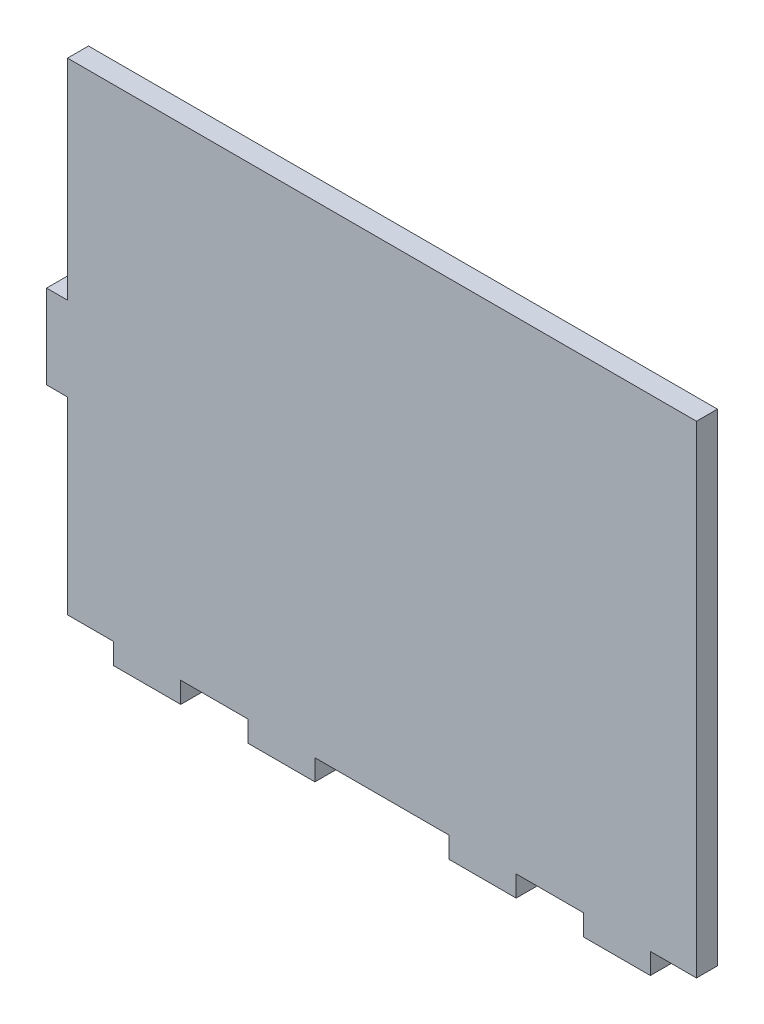
from build123d import *

# Parameters (mm, degrees)
BOSS_EXTRUDE1_DEPTH = 2.5
SKETCH2_W           = 0.314102564
SKETCH2_H           = 3.5
SKETCH2_W_2         = 0.179487179
SKETCH2_H_2         = 2
CUT_EXTRUDE1_DEPTH  = 1


with BuildPart() as part:
    # Sketch1 → Boss-Extrude1 (new body)
    with BuildSketch(Plane.XY):
        Polygon((-8, -31.25), (-8, -28.75), (8, -28.75), (8, -31.25), (16, -31.25), (16, -28.75), (24, -28.75), (24, -31.25), (32, -31.25), (32, -28.75), (37.5, -28.75), (37.5, 28.75), (-37.5, 28.75), (-37.5, 3.75), (-40, 3.75), (-40, -6.25), (-37.5, -6.25), (-37.5, -28.75), (-32, -28.75), (-32, -31.25), (-24, -31.25), (-24, -28.75), (-16, -28.75), (-16, -31.25), align=None)
    extrude(amount=BOSS_EXTRUDE1_DEPTH)

    # Sketch2 → Cut-Extrude1 (cut)
    # profile 1 of 19: a face of its own
    with BuildSketch(Plane.XY):
        Polygon((-30.318454681, -16.75), (-32.292813655, -16.75), (-32.292813655, -17.108974359), (-30.632557245, -17.108974359), (-30.632557245, -18.185897436), (-32.292813655, -18.185897436), (-32.292813655, -18.544871795), (-30.632557245, -18.544871795), (-30.632557245, -19.891025641), (-32.292813655, -19.891025641), (-32.292813655, -20.25), (-30.318454681, -20.25), align=None)
    # profile 2 of 19: a face of its own
    with BuildSketch(Plane.XY):
        Polygon((-27.940249553, -17.108974359), (-27.940249553, -16.75), (-29.779993142, -16.75), (-29.779993142, -17.108974359), (-29.017172629, -17.108974359), (-29.017172629, -20.25), (-28.703070065, -20.25), (-28.703070065, -17.108974359), align=None)
    # profile 3 of 19: a face of its own
    with BuildSketch(Plane.XY):
        with Locations((-27.289608527, -18.5)):
            Rectangle(SKETCH2_W, SKETCH2_H)
    # profile 4 of 19: a face of its own
    with BuildSketch(Plane.XY):
        with BuildLine():
            Line((-24.350505963, -19.574819712), (-24.64637936, -19.397435897))
            add(Edge.make_bspline(
                [(-24.64637936, -19.397435897), (-24.673897597, -19.443500282), (-24.726621478, -19.531757866), (-24.814572837, -19.651015907), (-24.905705748, -19.752378063), (-25.000695082, -19.835254671), (-25.09896103, -19.900503558), (-25.201145084, -19.946705789), (-25.306902895, -19.975521765), (-25.378876716, -19.979021851), (-25.414808847, -19.980769231)],
                knots=[0, 0, 0, 0, 1.272034388, 2.437168799, 3.508375237, 4.49857839, 5.41946034, 6.295179144, 7.148887113, 8, 8, 8, 8], degree=3))
            add(Edge.make_bspline(
                [(-25.414808847, -19.980769231), (-25.445495708, -19.979914558), (-25.506332481, -19.978220168), (-25.595894724, -19.961939366), (-25.682876526, -19.936927237), (-25.765485164, -19.901106306), (-25.842580778, -19.85776782), (-25.910187474, -19.805421642), (-25.968633587, -19.746815437), (-26.016442702, -19.681432782), (-26.053122737, -19.611115633), (-26.081314805, -19.538939682), (-26.096959879, -19.463771114), (-26.099316632, -19.413160651), (-26.100505963, -19.387620192)],
                knots=[0, 0, 0, 0, 1.095163259, 2.171163733, 3.241058638, 4.321873601, 5.38011039, 6.391990106, 7.366004449, 8.327778327, 9.272591725, 10.192022065, 11.087607919, 12, 12, 12, 12], degree=3))
            add(Edge.make_bspline(
                [(-26.100505963, -19.387620192), (-26.099031652, -19.358479343), (-26.096034594, -19.299240253), (-26.070703114, -19.2118406), (-26.030853867, -19.12534803), (-25.994091223, -19.071846765), (-25.975005161, -19.044070513)],
                knots=[0, 0, 0, 0, 0.938893495, 1.908633276, 2.914225137, 4, 4, 4, 4], degree=3))
            add(Edge.make_bspline(
                [(-25.975005161, -19.044070513), (-25.959334547, -19.024023689), (-25.926436053, -18.981937891), (-25.86987854, -18.919292655), (-25.803512426, -18.854674236), (-25.729608871, -18.785615179), (-25.645475782, -18.715327383), (-25.553748268, -18.640459105), (-25.452084409, -18.563857528), (-25.380784912, -18.512484962), (-25.343995546, -18.485977564)],
                knots=[0, 0, 0, 0, 0.722233717, 1.516239348, 2.393582979, 3.351407094, 4.387010283, 5.505090956, 6.712668013, 8, 8, 8, 8], degree=3))
            add(Edge.make_bspline(
                [(-25.343995546, -18.485977564), (-25.30717155, -18.459748976), (-25.236766873, -18.409601914), (-25.138308291, -18.33517763), (-25.050263828, -18.267133761), (-24.973024811, -18.204829749), (-24.906625215, -18.148257144), (-24.850541804, -18.097959205), (-24.806203247, -18.052575644), (-24.781547666, -18.023134302), (-24.770477918, -18.009915865)],
                knots=[0, 0, 0, 0, 1.452282411, 2.77665338, 3.964542531, 5.026858415, 5.96415736, 6.766646006, 7.446254459, 8, 8, 8, 8], degree=3))
            add(Edge.make_bspline(
                [(-24.770477918, -18.009915865), (-24.755005373, -17.989314829), (-24.724576536, -17.948800125), (-24.68441053, -17.885475267), (-24.650271368, -17.820652002), (-24.623509036, -17.754156137), (-24.600972817, -17.686921208), (-24.585814886, -17.618069962), (-24.576323489, -17.547911344), (-24.575351503, -17.500697843), (-24.574864937, -17.477063301)],
                knots=[0, 0, 0, 0, 1.068054152, 2.10047183, 3.106115577, 4.101338837, 5.06977816, 6.043150881, 7.020423561, 8, 8, 8, 8], degree=3))
            add(Edge.make_bspline(
                [(-24.574864937, -17.477063301), (-24.576170146, -17.440033527), (-24.578752666, -17.366765463), (-24.600593183, -17.259734633), (-24.635066077, -17.157548215), (-24.683360965, -17.061217882), (-24.745618318, -16.973251901), (-24.817664292, -16.892638414), (-24.903475778, -16.824869832), (-24.997628402, -16.765657773), (-25.100684774, -16.719311848), (-25.208675677, -16.684350868), (-25.321772749, -16.66454161), (-25.398375884, -16.661698845), (-25.437244745, -16.66025641)],
                knots=[0, 0, 0, 0, 1.005424448, 1.989358655, 2.955360095, 3.929531133, 4.905563448, 5.876582895, 6.856512386, 7.866279853, 8.892233794, 9.918561126, 10.94386622, 12, 12, 12, 12], degree=3))
            add(Edge.make_bspline(
                [(-25.437244745, -16.66025641), (-25.478488845, -16.661678962), (-25.560510197, -16.664507963), (-25.681159412, -16.689105494), (-25.797320129, -16.729806166), (-25.890763394, -16.775994824), (-25.963896155, -16.82212624), (-26.019668888, -16.864146064), (-26.076186339, -16.912521173), (-26.133904393, -16.967380419), (-26.191845053, -17.02922717), (-26.250868505, -17.097637859), (-26.311112774, -17.172194415), (-26.349868634, -17.225418915), (-26.369736732, -17.252704327)],
                knots=[0, 0, 0, 0, 1.286793592, 2.559021753, 3.825965368, 5.121522368, 5.803751409, 6.523245864, 7.299691795, 8.125521123, 9.008227632, 9.944561021, 10.946284179, 12, 12, 12, 12], degree=3))
            Line((-26.369736732, -17.252704327), (-26.085782405, -17.467948718))
            add(Edge.make_bspline(
                [(-26.085782405, -17.467948718), (-26.068636473, -17.445860028), (-26.035617416, -17.403322374), (-25.985487929, -17.343751059), (-25.938239281, -17.289334579), (-25.891688881, -17.242069451), (-25.84829525, -17.199367318), (-25.806178207, -17.162807561), (-25.765943856, -17.132031966), (-25.715226945, -17.099188406), (-25.651509227, -17.066631902), (-25.571524691, -17.039082824), (-25.487938416, -17.022527762), (-25.431008784, -17.020338874), (-25.402188655, -17.019230769)],
                knots=[0, 0, 0, 0, 1.181633172, 2.275549214, 3.290209073, 4.226197932, 5.078386478, 5.862611352, 6.581680152, 7.217281963, 8.414376989, 9.595101626, 10.782541182, 12, 12, 12, 12], degree=3))
            add(Edge.make_bspline(
                [(-25.402188655, -17.019230769), (-25.366032133, -17.020442469), (-25.296307685, -17.022779118), (-25.197317449, -17.048299104), (-25.108223524, -17.088480964), (-25.031670959, -17.144795942), (-24.967933982, -17.211516935), (-24.921828523, -17.28829579), (-24.894078359, -17.373078192), (-24.890692079, -17.432219849), (-24.888967501, -17.462339744)],
                knots=[0, 0, 0, 0, 1.14458467, 2.207223713, 3.21896685, 4.227309161, 5.202851033, 6.127160689, 7.046193047, 8, 8, 8, 8], degree=3))
            add(Edge.make_bspline(
                [(-24.888967501, -17.462339744), (-24.889360628, -17.481091222), (-24.890147524, -17.518624842), (-24.901122322, -17.574076264), (-24.915221651, -17.629387603), (-24.937564282, -17.684310186), (-24.968409586, -17.739804545), (-25.008914762, -17.796826282), (-25.059928074, -17.855877991), (-25.099005086, -17.894285365), (-25.119636572, -17.914563301)],
                knots=[0, 0, 0, 0, 0.858281714, 1.717966888, 2.583508476, 3.4729293, 4.427298488, 5.488583878, 6.674047936, 8, 8, 8, 8], degree=3))
            add(Edge.make_bspline(
                [(-25.119636572, -17.914563301), (-25.127297944, -17.921400327), (-25.145499611, -17.937643535), (-25.178775537, -17.964235816), (-25.222718335, -17.997038588), (-25.276180536, -18.037625905), (-25.340147898, -18.084707367), (-25.414627454, -18.137680979), (-25.498788987, -18.198266438), (-25.558510903, -18.240623979), (-25.590089296, -18.263020833)],
                knots=[0, 0, 0, 0, 0.420754252, 0.999615792, 1.744751191, 2.668019286, 3.750313428, 4.999500688, 6.413464383, 8, 8, 8, 8], degree=3))
            add(Edge.make_bspline(
                [(-25.590089296, -18.263020833), (-25.628075209, -18.290662193), (-25.701629666, -18.344185855), (-25.806287246, -18.424601535), (-25.901181054, -18.503249303), (-25.986644257, -18.57962691), (-26.063521166, -18.653155003), (-26.130958886, -18.724718184), (-26.189644567, -18.793803756), (-26.252823785, -18.882376332), (-26.317381605, -18.991157416), (-26.372823112, -19.124435655), (-26.40778146, -19.258231975), (-26.412352975, -19.348158812), (-26.414608527, -19.392528045)],
                knots=[0, 0, 0, 0, 1.163667725, 2.253281268, 3.268753668, 4.215851969, 5.092017293, 5.902905408, 6.650798638, 7.335211899, 8.59617414, 9.77448103, 10.901945474, 12, 12, 12, 12], degree=3))
            add(Edge.make_bspline(
                [(-26.414608527, -19.392528045), (-26.413951389, -19.42390641), (-26.412649874, -19.486053794), (-26.39768896, -19.57730887), (-26.375769295, -19.66593974), (-26.342732061, -19.750850853), (-26.302408903, -19.833595615), (-26.251242655, -19.912003516), (-26.19193497, -19.987809914), (-26.123901205, -20.058993406), (-26.049455303, -20.124339602), (-25.970771608, -20.182468663), (-25.887721335, -20.230936986), (-25.800755018, -20.270487828), (-25.709852682, -20.301421346), (-25.615044898, -20.323834215), (-25.516175387, -20.337589926), (-25.448974905, -20.339017687), (-25.414808847, -20.33974359)],
                knots=[0, 0, 0, 0, 0.983748083, 1.948392443, 2.894712957, 3.844097841, 4.80183111, 5.778335162, 6.776009319, 7.81870978, 8.863265674, 9.881300176, 10.883814829, 11.87499822, 12.874611388, 13.892143829, 14.928324115, 16, 16, 16, 16], degree=3))
            add(Edge.make_bspline(
                [(-25.414808847, -20.33974359), (-25.388373504, -20.339232408), (-25.335835744, -20.338216483), (-25.258126262, -20.329235202), (-25.181986673, -20.316528099), (-25.108372391, -20.296354029), (-25.03633498, -20.271877052), (-24.966187745, -20.241738719), (-24.897896691, -20.205621518), (-24.831079108, -20.164326493), (-24.765904934, -20.116268748), (-24.702985466, -20.060295252), (-24.64025628, -19.997949747), (-24.579568884, -19.927539184), (-24.51969574, -19.850201101), (-24.46181733, -19.765211917), (-24.404735612, -19.673034564), (-24.368920145, -19.608169478), (-24.350505963, -19.574819712)],
                knots=[0, 0, 0, 0, 0.915332311, 1.819136955, 2.706846663, 3.586547465, 4.459518054, 5.340707479, 6.227863349, 7.133153174, 8.059268498, 9.028702269, 10.047606654, 11.120612155, 12.245963614, 13.433783089, 14.680604001, 16, 16, 16, 16], degree=3))
        make_face()
    # profile 5 of 19: a face of its own
    with BuildSketch(Plane.XY):
        with BuildLine():
            add(Edge.make_bspline(
                [(-22.129352117, -16.66025641), (-22.194160223, -16.66189789), (-22.321448689, -16.665121891), (-22.508523587, -16.689800994), (-22.687118682, -16.732496384), (-22.858688821, -16.789359367), (-23.021181798, -16.865213752), (-23.17582069, -16.9568989), (-23.322237564, -17.065375359), (-23.458458946, -17.189804586), (-23.583115896, -17.32518804), (-23.692941782, -17.46966595), (-23.784984076, -17.622364752), (-23.860569863, -17.782825583), (-23.919868473, -17.950685551), (-23.960787517, -18.126839554), (-23.986925667, -18.310146244), (-23.989981444, -18.435173108), (-23.991531604, -18.498597756)],
                knots=[0, 0, 0, 0, 1.065120563, 2.091984664, 3.0946048, 4.079830382, 5.057816894, 6.036188127, 7.030412546, 8.04752943, 9.064399622, 10.05169764, 11.02544977, 11.989514704, 12.962713494, 13.945757189, 14.957906945, 16, 16, 16, 16], degree=3))
            add(Edge.make_bspline(
                [(-23.991531604, -18.498597756), (-23.989981671, -18.561555203), (-23.986926575, -18.685651623), (-23.960757797, -18.867795067), (-23.919716797, -19.042885764), (-23.861120531, -19.210631417), (-23.785895053, -19.37120898), (-23.693239881, -19.524195934), (-23.584098671, -19.669642433), (-23.45989182, -19.805955098), (-23.324490778, -19.930952569), (-23.179260511, -20.039871444), (-23.027467191, -20.133595569), (-22.867157483, -20.208379243), (-22.700457446, -20.268151163), (-22.525875123, -20.308903793), (-22.344228569, -20.335190837), (-22.220357565, -20.338209353), (-22.157396988, -20.33974359)],
                knots=[0, 0, 0, 0, 1.043624062, 2.057103931, 3.04512605, 4.022047818, 4.998200453, 5.980619268, 6.982898556, 8.009068085, 9.034988726, 10.034168286, 11.015286542, 11.987931943, 12.962482838, 13.94673481, 14.956375938, 16, 16, 16, 16], degree=3))
            add(Edge.make_bspline(
                [(-22.157396988, -20.33974359), (-22.093972669, -20.338194203), (-21.968946453, -20.335139949), (-21.785409418, -20.308958544), (-21.609131674, -20.26801724), (-21.440617323, -20.209507804), (-21.279772393, -20.133890573), (-21.126282311, -20.041686194), (-20.980763164, -19.932279053), (-20.844421417, -19.808112479), (-20.719672219, -19.672940927), (-20.610912843, -19.528106671), (-20.51868773, -19.376451215), (-20.443324397, -19.217553691), (-20.383659938, -19.052182248), (-20.34295512, -18.879233771), (-20.316619168, -18.699694265), (-20.313584321, -18.577451366), (-20.312044424, -18.515424679)],
                knots=[0, 0, 0, 0, 1.053102029, 2.075944431, 3.073151272, 4.055350789, 5.033113405, 6.020478099, 7.024410459, 8.052272461, 9.079885166, 10.07527673, 11.055994387, 12.023226415, 12.992069828, 13.970394897, 14.97016774, 16, 16, 16, 16], degree=3))
            add(Edge.make_bspline(
                [(-20.312044424, -18.515424679), (-20.31257906, -18.47379201), (-20.313641586, -18.391051887), (-20.326433279, -18.268185287), (-20.34499498, -18.147294629), (-20.371596892, -18.028723681), (-20.406388559, -17.912762696), (-20.447440587, -17.798611933), (-20.497580432, -17.68742821), (-20.55426108, -17.578684818), (-20.617522888, -17.474076912), (-20.687398638, -17.375197329), (-20.761434006, -17.281216332), (-20.8425974, -17.194569328), (-20.928213845, -17.112735672), (-21.019672223, -17.036972955), (-21.116414467, -16.966598004), (-21.218856847, -16.903177663), (-21.324475122, -16.845818528), (-21.4333519, -16.796596677), (-21.544008471, -16.754350616), (-21.656963119, -16.720109791), (-21.771915891, -16.693077755), (-21.889117676, -16.674670401), (-22.008475102, -16.661846083), (-22.088886421, -16.660788581), (-22.129352117, -16.66025641)],
                knots=[0, 0, 0, 0, 1.037015668, 2.060948919, 3.074880161, 4.083647147, 5.086022904, 6.090072063, 7.104153813, 8.122640571, 9.144368836, 10.147691507, 11.138137339, 12.123020368, 13.103399296, 14.087645067, 15.080126199, 16.082011238, 17.087798457, 18.072939717, 19.057185487, 20.037253025, 21.01195951, 21.997135196, 22.992090687, 24, 24, 24, 24], degree=3))
        make_face()
        with BuildLine():
            add(Edge.make_bspline(
                [(-22.144776796, -17.019230769), (-22.111562163, -17.019635659), (-22.04545043, -17.020441569), (-21.947165893, -17.031057285), (-21.85017396, -17.046187174), (-21.754454597, -17.067768695), (-21.660408308, -17.097172747), (-21.567158467, -17.131013655), (-21.475555413, -17.172234746), (-21.385901555, -17.21880745), (-21.29898648, -17.270356371), (-21.216973778, -17.327328138), (-21.139651135, -17.388386693), (-21.067207868, -17.45367453), (-20.999856696, -17.523524132), (-20.936271994, -17.596876568), (-20.879002413, -17.675828459), (-20.826516836, -17.758238866), (-20.779548996, -17.844000447), (-20.737783641, -17.932210309), (-20.703619632, -18.023587996), (-20.675757256, -18.117142154), (-20.652657445, -18.212724613), (-20.638023521, -18.311060462), (-20.627291161, -18.411655574), (-20.626531316, -18.479637428), (-20.626146988, -18.514022436)],
                knots=[0, 0, 0, 0, 1.008559885, 2.007477868, 2.99961109, 3.989939068, 4.984837346, 5.991145699, 7.001802488, 8.033829008, 9.059044045, 10.069351652, 11.065060232, 12.050310815, 13.029377138, 14.011219647, 14.996725999, 15.989392538, 16.977580475, 17.965360261, 18.951710183, 19.937753436, 20.929683414, 21.935841486, 22.955955122, 24, 24, 24, 24], degree=3))
            add(Edge.make_bspline(
                [(-20.626146988, -18.514022436), (-20.62742185, -18.564584657), (-20.629929898, -18.664056187), (-20.651887468, -18.809824331), (-20.685709443, -18.949912617), (-20.735566809, -19.083554526), (-20.797917424, -19.211898809), (-20.874944314, -19.333806914), (-20.9662034, -19.449311788), (-21.069866926, -19.557607057), (-21.183189633, -19.656452862), (-21.303522363, -19.74321627), (-21.42957597, -19.81662652), (-21.561679173, -19.876431592), (-21.699126712, -19.92382133), (-21.842804263, -19.956299961), (-21.991754723, -19.977675417), (-22.093285378, -19.979728173), (-22.144776796, -19.980769231)],
                knots=[0, 0, 0, 0, 1.032063989, 2.030389145, 3.003944642, 3.970395727, 4.937377036, 5.913328081, 6.909231446, 7.93887556, 8.970685674, 9.976071282, 10.964166581, 11.944589148, 12.933237628, 13.927779006, 14.949070134, 16, 16, 16, 16], degree=3))
            add(Edge.make_bspline(
                [(-22.144776796, -19.980769231), (-22.179386298, -19.980293726), (-22.248027334, -19.979350658), (-22.350122856, -19.969851982), (-22.450379068, -19.954620112), (-22.548655348, -19.932689457), (-22.644840159, -19.90524225), (-22.739334963, -19.872634522), (-22.831133253, -19.831953318), (-22.921393091, -19.787005367), (-23.007789332, -19.735765209), (-23.090264865, -19.68072706), (-23.166740845, -19.619758439), (-23.239129916, -19.555440626), (-23.306757605, -19.486476779), (-23.369166589, -19.412956557), (-23.426146721, -19.3344159), (-23.478612368, -19.252130494), (-23.525415631, -19.166134241), (-23.56619473, -19.077604563), (-23.600790846, -18.986759454), (-23.62871935, -18.893467882), (-23.650604812, -18.797907034), (-23.665684732, -18.699948955), (-23.676233171, -18.599789613), (-23.677028248, -18.532045757), (-23.67742904, -18.497896635)],
                knots=[0, 0, 0, 0, 1.047197238, 2.076906641, 3.100256066, 4.114471768, 5.12198147, 6.126382909, 7.136867548, 8.15857795, 9.17633901, 10.174870724, 11.156907918, 12.133735059, 13.104061851, 14.077631395, 15.04955518, 16.038496417, 17.029181396, 18.010275684, 18.986308667, 19.968651475, 20.955262928, 21.950658345, 22.966943676, 24, 24, 24, 24], degree=3))
            add(Edge.make_bspline(
                [(-23.67742904, -18.497896635), (-23.677027927, -18.46398113), (-23.676232245, -18.39670348), (-23.665689771, -18.297242662), (-23.65058888, -18.19998945), (-23.628826172, -18.105325647), (-23.600776018, -18.013227122), (-23.566188688, -17.923780375), (-23.525403389, -17.836652179), (-23.478595164, -17.752057882), (-23.425979341, -17.670883145), (-23.368485097, -17.593280732), (-23.305119749, -17.520707991), (-23.237693724, -17.451373297), (-23.164522839, -17.386755407), (-23.085938545, -17.326832886), (-23.002894867, -17.270159612), (-22.914967632, -17.21903405), (-22.824223678, -17.171819818), (-22.73110972, -17.131368814), (-22.63668062, -17.096996695), (-22.541176508, -17.06767973), (-22.44379353, -17.0462717), (-22.345189701, -17.03104365), (-22.245501442, -17.020445264), (-22.178458223, -17.019636886), (-22.144776796, -17.019230769)],
                knots=[0, 0, 0, 0, 1.02996197, 2.043119294, 3.035359645, 4.018872909, 4.991431989, 5.957985074, 6.929999688, 7.912076566, 8.892894881, 9.867085534, 10.843653904, 11.817741046, 12.803660682, 13.806313499, 14.818574707, 15.856120519, 16.894564902, 17.924820532, 18.937903209, 19.946497019, 20.957711757, 21.963978472, 22.977135795, 24, 24, 24, 24], degree=3))
        make_face(mode=Mode.SUBTRACT)
    # profile 6 of 19: a face of its own
    with BuildSketch(Plane.XY):
        with BuildLine():
            Line((-17.619736732, -16.75), (-18.306134969, -16.75))
            add(Edge.make_bspline(
                [(-18.306134969, -16.75), (-18.353345875, -16.750051896), (-18.443804068, -16.750151332), (-18.573519124, -16.753166078), (-18.691328855, -16.75719277), (-18.796979236, -16.762774663), (-18.890795334, -16.769371253), (-18.972352634, -16.778623292), (-19.04229219, -16.788283588), (-19.08419864, -16.798104995), (-19.10331045, -16.802584135)],
                knots=[0, 0, 0, 0, 1.415646017, 2.712440637, 3.8905458, 4.950247383, 5.884950622, 6.709939814, 7.411656543, 8, 8, 8, 8], degree=3))
            add(Edge.make_bspline(
                [(-19.10331045, -16.802584135), (-19.127503984, -16.809206084), (-19.175320961, -16.822293946), (-19.244222004, -16.84850767), (-19.30977585, -16.879589835), (-19.372207408, -16.915013775), (-19.430749491, -16.956299339), (-19.486275532, -17.001772957), (-19.538295512, -17.052484525), (-19.586516904, -17.107865265), (-19.630801702, -17.166985475), (-19.668931385, -17.230727705), (-19.700858612, -17.298019008), (-19.728241883, -17.368812579), (-19.747950337, -17.443702903), (-19.762797237, -17.522169615), (-19.772220865, -17.604204305), (-19.773123427, -17.660264173), (-19.773582886, -17.688802083)],
                knots=[0, 0, 0, 0, 0.999701418, 1.975846123, 2.934577507, 3.890451536, 4.834027766, 5.787354733, 6.749476667, 7.726910423, 8.712836071, 9.690891519, 10.682875813, 11.679750201, 12.712814741, 13.765529915, 14.8625177, 16, 16, 16, 16], degree=3))
            add(Edge.make_bspline(
                [(-19.773582886, -17.688802083), (-19.773161461, -17.71757986), (-19.772336915, -17.773885524), (-19.76244063, -17.856258312), (-19.749110438, -17.934976702), (-19.728613386, -18.009866153), (-19.701767713, -18.080481923), (-19.67027566, -18.147903155), (-19.63229213, -18.210982827), (-19.5886473, -18.269949945), (-19.540095705, -18.324859857), (-19.486842767, -18.375314652), (-19.429103475, -18.42101899), (-19.367061327, -18.462075334), (-19.300111478, -18.497531613), (-19.229269324, -18.529288918), (-19.153919108, -18.555959979), (-19.101776594, -18.56999004), (-19.075265578, -18.577123397)],
                knots=[0, 0, 0, 0, 1.121902311, 2.195077645, 3.232258892, 4.234102512, 5.217864754, 6.176164875, 7.132989551, 8.084763148, 9.034132444, 9.988522005, 10.94243251, 11.903244335, 12.886203696, 13.894208494, 14.929344452, 16, 16, 16, 16], degree=3))
            add(Edge.make_bspline(
                [(-19.075265578, -18.577123397), (-19.053338244, -18.581786379), (-19.005283217, -18.592005573), (-18.926140495, -18.60341403), (-18.833995109, -18.61315163), (-18.728972829, -18.620452768), (-18.611167924, -18.626703136), (-18.480516667, -18.63167123), (-18.336762589, -18.634401084), (-18.236491345, -18.634541877), (-18.184139777, -18.634615385)],
                knots=[0, 0, 0, 0, 0.601384939, 1.31797006, 2.144135048, 3.087295005, 4.142315834, 5.309527816, 6.595305764, 8, 8, 8, 8], degree=3))
            Line((-18.184139777, -18.634615385), (-17.933839296, -18.634615385))
            Line((-17.933839296, -18.634615385), (-17.933839296, -20.25))
            Line((-17.933839296, -20.25), (-17.619736732, -20.25))
            Line((-17.619736732, -20.25), (-17.619736732, -16.75))
        make_face()
        with BuildLine():
            Line((-17.933839296, -17.108974359), (-17.933839296, -18.275641026))
            Line((-17.933839296, -18.275641026), (-18.546619745, -18.283353365))
            add(Edge.make_bspline(
                [(-18.546619745, -18.283353365), (-18.576539671, -18.283368829), (-18.634299471, -18.283398681), (-18.717735694, -18.279413458), (-18.795144981, -18.274812925), (-18.866289556, -18.268077002), (-18.931201491, -18.258555744), (-18.98998902, -18.248944006), (-19.042196303, -18.235038644), (-19.103295504, -18.216315574), (-19.171378852, -18.184382959), (-19.2454464, -18.138033069), (-19.308216987, -18.07895236), (-19.362535284, -18.012524529), (-19.405641162, -17.9386254), (-19.437197154, -17.859556463), (-19.455738311, -17.776128613), (-19.458224505, -17.719040475), (-19.459480322, -17.690204327)],
                knots=[0, 0, 0, 0, 1.160613943, 2.240541288, 3.23993089, 4.169200891, 5.011653406, 5.7853311, 6.478053781, 7.106038997, 8.262395093, 9.384106736, 10.481365981, 11.59014053, 12.70357646, 13.786202915, 14.881775077, 16, 16, 16, 16], degree=3))
            add(Edge.make_bspline(
                [(-19.459480322, -17.690204327), (-19.458217675, -17.662065813), (-19.45570769, -17.606129931), (-19.437051827, -17.524151171), (-19.405702513, -17.445915466), (-19.362245919, -17.372942381), (-19.309504789, -17.306753577), (-19.248205446, -17.24925645), (-19.178492184, -17.203034747), (-19.113643953, -17.173201466), (-19.056042767, -17.15498619), (-19.006010807, -17.14224135), (-18.949520133, -17.132065743), (-18.886552353, -17.123826241), (-18.81759552, -17.116772779), (-18.742057205, -17.111986802), (-18.660223561, -17.109185346), (-18.603412991, -17.109046391), (-18.573963495, -17.108974359)],
                knots=[0, 0, 0, 0, 1.120700087, 2.227813068, 3.331159281, 4.466773991, 5.599788987, 6.693661531, 7.80175334, 8.91857717, 9.525282508, 10.207424825, 10.974604443, 11.810962634, 12.737642355, 13.736264703, 14.826523623, 16, 16, 16, 16], degree=3))
            Line((-18.573963495, -17.108974359), (-17.933839296, -17.108974359))
        make_face(mode=Mode.SUBTRACT)
    # profile 7 of 19: a face of its own
    with BuildSketch(Plane.XY):
        with BuildLine():
            Line((-14.74794186, -16.75), (-15.434340097, -16.75))
            add(Edge.make_bspline(
                [(-15.434340097, -16.75), (-15.481551004, -16.750051896), (-15.572009196, -16.750151332), (-15.701724252, -16.753166078), (-15.819533984, -16.75719277), (-15.925184365, -16.762774663), (-16.019000463, -16.769371253), (-16.100557762, -16.778623292), (-16.170497319, -16.788283588), (-16.212403768, -16.798104995), (-16.231515578, -16.802584135)],
                knots=[0, 0, 0, 0, 1.415646017, 2.712440637, 3.8905458, 4.950247383, 5.884950622, 6.709939814, 7.411656543, 8, 8, 8, 8], degree=3))
            add(Edge.make_bspline(
                [(-16.231515578, -16.802584135), (-16.255709112, -16.809206084), (-16.303526089, -16.822293946), (-16.372427132, -16.84850767), (-16.437980978, -16.879589835), (-16.500412536, -16.915013775), (-16.558954619, -16.956299339), (-16.61448066, -17.001772957), (-16.666500641, -17.052484525), (-16.714722032, -17.107865265), (-16.75900683, -17.166985475), (-16.797136513, -17.230727705), (-16.82906374, -17.298019008), (-16.856447011, -17.368812579), (-16.876155466, -17.443702903), (-16.891002365, -17.522169615), (-16.900425993, -17.604204305), (-16.901328555, -17.660264173), (-16.901788014, -17.688802083)],
                knots=[0, 0, 0, 0, 0.999701418, 1.975846123, 2.934577507, 3.890451536, 4.834027766, 5.787354733, 6.749476667, 7.726910423, 8.712836071, 9.690891519, 10.682875813, 11.679750201, 12.712814741, 13.765529915, 14.8625177, 16, 16, 16, 16], degree=3))
            add(Edge.make_bspline(
                [(-16.901788014, -17.688802083), (-16.901366589, -17.71757986), (-16.900542043, -17.773885524), (-16.890645758, -17.856258312), (-16.877315566, -17.934976702), (-16.856818514, -18.009866153), (-16.829972841, -18.080481923), (-16.798480788, -18.147903155), (-16.760497258, -18.210982827), (-16.716852428, -18.269949945), (-16.668300834, -18.324859857), (-16.615047896, -18.375314652), (-16.557308603, -18.42101899), (-16.495266455, -18.462075334), (-16.428316606, -18.497531613), (-16.357474453, -18.529288918), (-16.282124236, -18.555959979), (-16.229981722, -18.56999004), (-16.203470706, -18.577123397)],
                knots=[0, 0, 0, 0, 1.121902311, 2.195077645, 3.232258892, 4.234102512, 5.217864754, 6.176164875, 7.132989551, 8.084763148, 9.034132444, 9.988522005, 10.94243251, 11.903244335, 12.886203696, 13.894208494, 14.929344452, 16, 16, 16, 16], degree=3))
            add(Edge.make_bspline(
                [(-16.203470706, -18.577123397), (-16.181543372, -18.581786379), (-16.133488345, -18.592005573), (-16.054345623, -18.60341403), (-15.962200237, -18.61315163), (-15.857177957, -18.620452768), (-15.739373052, -18.626703136), (-15.608721795, -18.63167123), (-15.464967718, -18.634401084), (-15.364696473, -18.634541877), (-15.312344905, -18.634615385)],
                knots=[0, 0, 0, 0, 0.601384939, 1.31797006, 2.144135048, 3.087295005, 4.142315834, 5.309527816, 6.595305764, 8, 8, 8, 8], degree=3))
            Line((-15.312344905, -18.634615385), (-15.062044424, -18.634615385))
            Line((-15.062044424, -18.634615385), (-15.062044424, -20.25))
            Line((-15.062044424, -20.25), (-14.74794186, -20.25))
            Line((-14.74794186, -20.25), (-14.74794186, -16.75))
        make_face()
        with BuildLine():
            Line((-15.062044424, -17.108974359), (-15.062044424, -18.275641026))
            Line((-15.062044424, -18.275641026), (-15.674824873, -18.283353365))
            add(Edge.make_bspline(
                [(-15.674824873, -18.283353365), (-15.704744799, -18.283368829), (-15.762504599, -18.283398681), (-15.845940822, -18.279413458), (-15.923350109, -18.274812925), (-15.994494685, -18.268077002), (-16.059406619, -18.258555744), (-16.118194148, -18.248944006), (-16.170401431, -18.235038644), (-16.231500633, -18.216315574), (-16.29958398, -18.184382959), (-16.373651529, -18.138033069), (-16.436422115, -18.07895236), (-16.490740412, -18.012524529), (-16.53384629, -17.9386254), (-16.565402282, -17.859556463), (-16.583943439, -17.776128613), (-16.586429633, -17.719040475), (-16.58768545, -17.690204327)],
                knots=[0, 0, 0, 0, 1.160613943, 2.240541288, 3.23993089, 4.169200891, 5.011653406, 5.7853311, 6.478053781, 7.106038997, 8.262395093, 9.384106736, 10.481365981, 11.59014053, 12.70357646, 13.786202915, 14.881775077, 16, 16, 16, 16], degree=3))
            add(Edge.make_bspline(
                [(-16.58768545, -17.690204327), (-16.586422803, -17.662065813), (-16.583912818, -17.606129931), (-16.565256955, -17.524151171), (-16.533907641, -17.445915466), (-16.490451047, -17.372942381), (-16.437709917, -17.306753577), (-16.376410574, -17.24925645), (-16.306697313, -17.203034747), (-16.241849082, -17.173201466), (-16.184247895, -17.15498619), (-16.134215936, -17.14224135), (-16.077725261, -17.132065743), (-16.014757482, -17.123826241), (-15.945800648, -17.116772779), (-15.870262333, -17.111986802), (-15.78842869, -17.109185346), (-15.731618119, -17.109046391), (-15.702168623, -17.108974359)],
                knots=[0, 0, 0, 0, 1.120700087, 2.227813068, 3.331159281, 4.466773991, 5.599788987, 6.693661531, 7.80175334, 8.91857717, 9.525282508, 10.207424825, 10.974604443, 11.810962634, 12.737642355, 13.736264703, 14.826523623, 16, 16, 16, 16], degree=3))
            Line((-15.702168623, -17.108974359), (-15.062044424, -17.108974359))
        make_face(mode=Mode.SUBTRACT)
    # profile 8 of 19: a face of its own
    with BuildSketch(Plane.XY):
        with BuildLine():
            add(Edge.make_bspline(
                [(-12.167813655, -16.66025641), (-12.232621761, -16.66189789), (-12.359910228, -16.665121891), (-12.546985126, -16.689800994), (-12.725580221, -16.732496384), (-12.89715036, -16.789359367), (-13.059643336, -16.865213752), (-13.214282229, -16.9568989), (-13.360699103, -17.065375359), (-13.496920484, -17.189804586), (-13.621577434, -17.32518804), (-13.731403321, -17.46966595), (-13.823445614, -17.622364752), (-13.899031402, -17.782825583), (-13.958330011, -17.950685551), (-13.999249055, -18.126839554), (-14.025387205, -18.310146244), (-14.028442983, -18.435173108), (-14.029993142, -18.498597756)],
                knots=[0, 0, 0, 0, 1.065120563, 2.091984664, 3.0946048, 4.079830382, 5.057816894, 6.036188127, 7.030412546, 8.04752943, 9.064399622, 10.05169764, 11.02544977, 11.989514704, 12.962713494, 13.945757189, 14.957906945, 16, 16, 16, 16], degree=3))
            add(Edge.make_bspline(
                [(-14.029993142, -18.498597756), (-14.02844321, -18.561555203), (-14.025388113, -18.685651623), (-13.999219336, -18.867795067), (-13.958178336, -19.042885764), (-13.899582069, -19.210631417), (-13.824356591, -19.37120898), (-13.73170142, -19.524195934), (-13.622560209, -19.669642433), (-13.498353358, -19.805955098), (-13.362952316, -19.930952569), (-13.217722049, -20.039871444), (-13.065928729, -20.133595569), (-12.905619021, -20.208379243), (-12.738918984, -20.268151163), (-12.564336661, -20.308903793), (-12.382690107, -20.335190837), (-12.258819103, -20.338209353), (-12.195858527, -20.33974359)],
                knots=[0, 0, 0, 0, 1.043624062, 2.057103931, 3.04512605, 4.022047818, 4.998200453, 5.980619268, 6.982898556, 8.009068085, 9.034988726, 10.034168286, 11.015286542, 11.987931943, 12.962482838, 13.94673481, 14.956375938, 16, 16, 16, 16], degree=3))
            add(Edge.make_bspline(
                [(-12.195858527, -20.33974359), (-12.132434208, -20.338194203), (-12.007407992, -20.335139949), (-11.823870957, -20.308958544), (-11.647593213, -20.26801724), (-11.479078862, -20.209507804), (-11.318233932, -20.133890573), (-11.164743849, -20.041686194), (-11.019224702, -19.932279053), (-10.882882955, -19.808112479), (-10.758133757, -19.672940927), (-10.649374382, -19.528106671), (-10.557149268, -19.376451215), (-10.481785936, -19.217553691), (-10.422121476, -19.052182248), (-10.381416658, -18.879233771), (-10.355080706, -18.699694265), (-10.35204586, -18.577451366), (-10.350505963, -18.515424679)],
                knots=[0, 0, 0, 0, 1.053102029, 2.075944431, 3.073151272, 4.055350789, 5.033113405, 6.020478099, 7.024410459, 8.052272461, 9.079885166, 10.07527673, 11.055994387, 12.023226415, 12.992069828, 13.970394897, 14.97016774, 16, 16, 16, 16], degree=3))
            add(Edge.make_bspline(
                [(-10.350505963, -18.515424679), (-10.351040598, -18.47379201), (-10.352103125, -18.391051887), (-10.364894817, -18.268185287), (-10.383456518, -18.147294629), (-10.410058431, -18.028723681), (-10.444850098, -17.912762696), (-10.485902125, -17.798611933), (-10.536041971, -17.68742821), (-10.592722619, -17.578684818), (-10.655984427, -17.474076912), (-10.725860176, -17.375197329), (-10.799895545, -17.281216332), (-10.881058938, -17.194569328), (-10.966675383, -17.112735672), (-11.058133762, -17.036972955), (-11.154876006, -16.966598004), (-11.257318386, -16.903177663), (-11.362936661, -16.845818528), (-11.471813438, -16.796596677), (-11.58247001, -16.754350616), (-11.695424658, -16.720109791), (-11.81037743, -16.693077755), (-11.927579214, -16.674670401), (-12.046936641, -16.661846083), (-12.12734796, -16.660788581), (-12.167813655, -16.66025641)],
                knots=[0, 0, 0, 0, 1.037015668, 2.060948919, 3.074880161, 4.083647147, 5.086022904, 6.090072063, 7.104153813, 8.122640571, 9.144368836, 10.147691507, 11.138137339, 12.123020368, 13.103399296, 14.087645067, 15.080126199, 16.082011238, 17.087798457, 18.072939717, 19.057185487, 20.037253025, 21.01195951, 21.997135196, 22.992090687, 24, 24, 24, 24], degree=3))
        make_face()
        with BuildLine():
            add(Edge.make_bspline(
                [(-12.183238335, -17.019230769), (-12.150023701, -17.019635659), (-12.083911968, -17.020441569), (-11.985627432, -17.031057285), (-11.888635498, -17.046187174), (-11.792916136, -17.067768695), (-11.698869846, -17.097172747), (-11.605620005, -17.131013655), (-11.514016951, -17.172234746), (-11.424363094, -17.21880745), (-11.337448018, -17.270356371), (-11.255435317, -17.327328138), (-11.178112673, -17.388386693), (-11.105669406, -17.45367453), (-11.038318234, -17.523524132), (-10.974733533, -17.596876568), (-10.917463951, -17.675828459), (-10.864978374, -17.758238866), (-10.818010534, -17.844000447), (-10.776245179, -17.932210309), (-10.74208117, -18.023587996), (-10.714218794, -18.117142154), (-10.691118983, -18.212724613), (-10.676485059, -18.311060462), (-10.6657527, -18.411655574), (-10.664992854, -18.479637428), (-10.664608527, -18.514022436)],
                knots=[0, 0, 0, 0, 1.008559885, 2.007477868, 2.99961109, 3.989939068, 4.984837346, 5.991145699, 7.001802488, 8.033829008, 9.059044045, 10.069351652, 11.065060232, 12.050310815, 13.029377138, 14.011219647, 14.996725999, 15.989392538, 16.977580475, 17.965360261, 18.951710183, 19.937753436, 20.929683414, 21.935841486, 22.955955122, 24, 24, 24, 24], degree=3))
            add(Edge.make_bspline(
                [(-10.664608527, -18.514022436), (-10.665883389, -18.564584657), (-10.668391437, -18.664056187), (-10.690349007, -18.809824331), (-10.724170981, -18.949912617), (-10.774028348, -19.083554526), (-10.836378962, -19.211898809), (-10.913405853, -19.333806914), (-11.004664938, -19.449311788), (-11.108328465, -19.557607057), (-11.221651171, -19.656452862), (-11.341983901, -19.74321627), (-11.468037509, -19.81662652), (-11.600140712, -19.876431592), (-11.737588251, -19.92382133), (-11.881265802, -19.956299961), (-12.030216261, -19.977675417), (-12.131746916, -19.979728173), (-12.183238335, -19.980769231)],
                knots=[0, 0, 0, 0, 1.032063989, 2.030389145, 3.003944642, 3.970395727, 4.937377036, 5.913328081, 6.909231446, 7.93887556, 8.970685674, 9.976071282, 10.964166581, 11.944589148, 12.933237628, 13.927779006, 14.949070134, 16, 16, 16, 16], degree=3))
            add(Edge.make_bspline(
                [(-12.183238335, -19.980769231), (-12.217847836, -19.980293726), (-12.286488873, -19.979350658), (-12.388584395, -19.969851982), (-12.488840607, -19.954620112), (-12.587116887, -19.932689457), (-12.683301698, -19.90524225), (-12.777796501, -19.872634522), (-12.869594791, -19.831953318), (-12.959854629, -19.787005367), (-13.046250871, -19.735765209), (-13.128726403, -19.68072706), (-13.205202383, -19.619758439), (-13.277591454, -19.555440626), (-13.345219143, -19.486476779), (-13.407628128, -19.412956557), (-13.46460826, -19.3344159), (-13.517073906, -19.252130494), (-13.563877169, -19.166134241), (-13.604656268, -19.077604563), (-13.639252384, -18.986759454), (-13.667180889, -18.893467882), (-13.689066351, -18.797907034), (-13.70414627, -18.699948955), (-13.714694709, -18.599789613), (-13.715489786, -18.532045757), (-13.715890578, -18.497896635)],
                knots=[0, 0, 0, 0, 1.047197238, 2.076906641, 3.100256066, 4.114471768, 5.12198147, 6.126382909, 7.136867548, 8.15857795, 9.17633901, 10.174870724, 11.156907918, 12.133735059, 13.104061851, 14.077631395, 15.04955518, 16.038496417, 17.029181396, 18.010275684, 18.986308667, 19.968651475, 20.955262928, 21.950658345, 22.966943676, 24, 24, 24, 24], degree=3))
            add(Edge.make_bspline(
                [(-13.715890578, -18.497896635), (-13.715489465, -18.46398113), (-13.714693784, -18.39670348), (-13.704151309, -18.297242662), (-13.689050419, -18.19998945), (-13.667287711, -18.105325647), (-13.639237557, -18.013227122), (-13.604650227, -17.923780375), (-13.563864927, -17.836652179), (-13.517056703, -17.752057882), (-13.464440879, -17.670883145), (-13.406946636, -17.593280732), (-13.343581288, -17.520707991), (-13.276155263, -17.451373297), (-13.202984378, -17.386755407), (-13.124400083, -17.326832886), (-13.041356406, -17.270159612), (-12.95342917, -17.21903405), (-12.862685217, -17.171819818), (-12.769571259, -17.131368814), (-12.675142159, -17.096996695), (-12.579638047, -17.06767973), (-12.482255068, -17.0462717), (-12.383651239, -17.03104365), (-12.283962981, -17.020445264), (-12.216919761, -17.019636886), (-12.183238335, -17.019230769)],
                knots=[0, 0, 0, 0, 1.02996197, 2.043119294, 3.035359645, 4.018872909, 4.991431989, 5.957985074, 6.929999688, 7.912076566, 8.892894881, 9.867085534, 10.843653904, 11.817741046, 12.803660682, 13.806313499, 14.818574707, 15.856120519, 16.894564902, 17.924820532, 18.937903209, 19.946497019, 20.957711757, 21.963978472, 22.977135795, 24, 24, 24, 24], degree=3))
        make_face(mode=Mode.SUBTRACT)
    # profile 9 of 19: a face of its own
    with BuildSketch(Plane.XY):
        Polygon((-30.584480322, -21.698717949), (-30.763967501, -21.698717949), (-30.763967501, -22.288461538), (-31.020377758, -22.288461538), (-31.020377758, -22.467948718), (-30.763967501, -22.467948718), (-30.763967501, -23.75), (-30.584480322, -23.75), (-30.584480322, -22.467948718), (-30.328070065, -22.467948718), (-30.328070065, -22.288461538), (-30.584480322, -22.288461538), align=None)
    # profile 10 of 19: a face of its own
    with BuildSketch(Plane.XY):
        with BuildLine():
            Line((-28.507557245, -22.288461538), (-28.687044424, -22.288461538))
            Line((-28.687044424, -22.288461538), (-28.687044424, -22.558894231))
            add(Edge.make_bspline(
                [(-28.687044424, -22.558894231), (-28.706105844, -22.534358383), (-28.743147898, -22.486677873), (-28.806990701, -22.424969228), (-28.874377449, -22.372926197), (-28.947042256, -22.332136178), (-29.023855793, -22.301381429), (-29.104502831, -22.278650314), (-29.18966784, -22.265255186), (-29.247894384, -22.263642808), (-29.277589296, -22.262820513)],
                knots=[0, 0, 0, 0, 1.0828784, 2.104357462, 3.088488658, 4.04616522, 5.001424249, 5.969181776, 6.964304535, 8, 8, 8, 8], degree=3))
            add(Edge.make_bspline(
                [(-29.277589296, -22.262820513), (-29.303527355, -22.263570901), (-29.354795291, -22.265054082), (-29.430259993, -22.275095827), (-29.502931641, -22.292305937), (-29.572399101, -22.31710646), (-29.639406566, -22.347766729), (-29.702962052, -22.386462178), (-29.764055512, -22.431265715), (-29.821150478, -22.482826945), (-29.873905545, -22.538614525), (-29.919531934, -22.598627271), (-29.958887308, -22.660891606), (-29.990698906, -22.726372801), (-30.015617962, -22.794555218), (-30.033340634, -22.865714327), (-30.043887859, -22.939586293), (-30.045302975, -22.989816419), (-30.046018783, -23.015224359)],
                knots=[0, 0, 0, 0, 1.041296284, 2.058176809, 3.050446431, 4.034000596, 5.01514041, 6.003636468, 7.015969324, 8.052561599, 9.08815499, 10.094063707, 11.074456064, 12.040834395, 13.011057502, 13.983766392, 14.980127149, 16, 16, 16, 16], degree=3))
            add(Edge.make_bspline(
                [(-30.046018783, -23.015224359), (-30.045318506, -23.041168535), (-30.043937458, -23.092334195), (-30.033226026, -23.167469679), (-30.016107812, -23.239748178), (-29.991503136, -23.309049472), (-29.959708, -23.375325844), (-29.921019679, -23.438529499), (-29.87537027, -23.498640187), (-29.823198197, -23.554841844), (-29.766596519, -23.60661288), (-29.706095096, -23.651891777), (-29.642632853, -23.68991542), (-29.576534472, -23.721677111), (-29.507234107, -23.745615502), (-29.435055091, -23.762882816), (-29.360036722, -23.7735311), (-29.309007492, -23.774932324), (-29.28319827, -23.775641026)],
                knots=[0, 0, 0, 0, 1.038740735, 2.04854663, 3.033179607, 4.009277356, 4.987731542, 5.972001279, 6.972200261, 8.005528982, 9.039189865, 10.040446548, 11.026516639, 11.997840187, 12.972163198, 13.956796175, 14.96660207, 16, 16, 16, 16], degree=3))
            add(Edge.make_bspline(
                [(-29.28319827, -23.775641026), (-29.254153944, -23.774901136), (-29.196782883, -23.773439636), (-29.1128985, -23.758628544), (-29.03216887, -23.736493152), (-28.955488399, -23.704093727), (-28.882249649, -23.662804861), (-28.812866903, -23.612456172), (-28.746971615, -23.553152958), (-28.707309468, -23.508163349), (-28.687044424, -23.485176282)],
                knots=[0, 0, 0, 0, 1.014726462, 2.004382257, 2.969841629, 3.936926163, 4.907207904, 5.903978561, 6.929055279, 8, 8, 8, 8], degree=3))
            Line((-28.687044424, -23.485176282), (-28.687044424, -24.288461538))
            Line((-28.687044424, -24.288461538), (-28.507557245, -24.288461538))
            Line((-28.507557245, -24.288461538), (-28.507557245, -22.288461538))
        make_face()
        with BuildLine():
            add(Edge.make_bspline(
                [(-29.275986732, -22.442307692), (-29.255655553, -22.442673554), (-29.215628703, -22.443393842), (-29.156958864, -22.451950384), (-29.100447191, -22.46437195), (-29.046663219, -22.48317875), (-28.995091438, -22.506263787), (-28.946129058, -22.53511065), (-28.899810448, -22.569197511), (-28.856252145, -22.607871421), (-28.816901691, -22.650485529), (-28.782065733, -22.695964277), (-28.752804415, -22.744250071), (-28.728517547, -22.794893135), (-28.710035671, -22.848290441), (-28.696918117, -22.904137877), (-28.688672201, -22.96249657), (-28.687592808, -23.002242859), (-28.687044424, -23.022435897)],
                knots=[0, 0, 0, 0, 1.05670511, 2.080379991, 3.077984906, 4.06214886, 5.038337365, 6.01289324, 7.01187578, 8.025460281, 9.038092164, 10.024533457, 11.000252242, 11.969694649, 12.940728589, 13.933144304, 14.949937299, 16, 16, 16, 16], degree=3))
            add(Edge.make_bspline(
                [(-28.687044424, -23.022435897), (-28.687953485, -23.04894339), (-28.689734412, -23.100873814), (-28.704212908, -23.176750455), (-28.727775916, -23.248551401), (-28.761220895, -23.315671994), (-28.803476652, -23.377376471), (-28.854389884, -23.432628246), (-28.913499913, -23.481080012), (-28.979824023, -23.521892157), (-29.050922383, -23.555028195), (-29.125085761, -23.578750601), (-29.201294265, -23.593363303), (-29.252819019, -23.595218628), (-29.278791219, -23.596153846)],
                knots=[0, 0, 0, 0, 1.03728447, 2.032128127, 3.01272805, 3.987917167, 4.958271349, 5.931593992, 6.91984656, 7.941419022, 8.973179163, 9.983609215, 10.983593296, 12, 12, 12, 12], degree=3))
            add(Edge.make_bspline(
                [(-29.278791219, -23.596153846), (-29.304240229, -23.595264488), (-29.35475194, -23.593499272), (-29.429128009, -23.578220307), (-29.501408374, -23.554880293), (-29.570082758, -23.520846261), (-29.634553323, -23.479137657), (-29.692771353, -23.429103352), (-29.743632447, -23.371109099), (-29.786983507, -23.306532811), (-29.821915784, -23.237289735), (-29.848161635, -23.165643227), (-29.863309392, -23.091845843), (-29.865456128, -23.042132864), (-29.866531604, -23.017227564)],
                knots=[0, 0, 0, 0, 1.00104056, 1.986885549, 2.97790532, 3.984399681, 4.995088187, 5.994304198, 6.996462723, 8.023150851, 9.048424203, 10.043036403, 11.019596776, 12, 12, 12, 12], degree=3))
            add(Edge.make_bspline(
                [(-29.866531604, -23.017227564), (-29.865700327, -22.99216757), (-29.864044251, -22.942242825), (-29.847731658, -22.868664024), (-29.823217385, -22.796728037), (-29.787469355, -22.72843058), (-29.74506863, -22.663988247), (-29.693784632, -22.607100317), (-29.636289662, -22.557288504), (-29.571895854, -22.516136841), (-29.50278704, -22.483402272), (-29.430035659, -22.459468764), (-29.354010743, -22.445083765), (-29.302223512, -22.44324119), (-29.275986732, -22.442307692)],
                knots=[0, 0, 0, 0, 0.983928682, 1.960191568, 2.949917689, 3.96440592, 4.982380491, 5.975291189, 6.965713506, 7.964880129, 8.970154049, 9.96478489, 10.968906225, 12, 12, 12, 12], degree=3))
        make_face(mode=Mode.SUBTRACT)
    # profile 11 of 19: a face of its own
    with BuildSketch(Plane.XY):
        Polygon((-26.892172629, -22.288461538), (-27.085682245, -22.288461538), (-27.580473911, -23.407852564), (-28.082877758, -22.288461538), (-28.276788014, -22.288461538), (-27.379352117, -24.288461538), (-27.18544186, -24.288461538), (-27.483118142, -23.625400641), align=None)
    # profile 12 of 19: a face of its own
    with BuildSketch(Plane.XY):
        with BuildLine():
            Line((-26.456275194, -22.288461538), (-26.635762373, -22.288461538))
            Line((-26.635762373, -22.288461538), (-26.635762373, -23.448317308))
            add(Edge.make_bspline(
                [(-26.635762373, -23.448317308), (-26.635604063, -23.473024505), (-26.635298486, -23.520715346), (-26.633097931, -23.589674363), (-26.628457544, -23.653369269), (-26.623195441, -23.71209056), (-26.615625889, -23.765566051), (-26.60638225, -23.813955311), (-26.595961862, -23.857304775), (-26.586807452, -23.884004684), (-26.582477117, -23.896634615)],
                knots=[0, 0, 0, 0, 1.307562039, 2.523909702, 3.650326591, 4.686913197, 5.643429486, 6.506965704, 7.293745905, 8, 8, 8, 8], degree=3))
            add(Edge.make_bspline(
                [(-26.582477117, -23.896634615), (-26.576083266, -23.913051713), (-26.563486737, -23.945395049), (-26.539894946, -23.991243232), (-26.513475572, -24.034412598), (-26.483300286, -24.07466257), (-26.449505541, -24.111791091), (-26.412887546, -24.146604805), (-26.372733151, -24.178367187), (-26.329065315, -24.206530214), (-26.282890668, -24.231894245), (-26.234235752, -24.253863712), (-26.18337493, -24.272999051), (-26.129830421, -24.287332077), (-26.074441715, -24.299751917), (-26.016557469, -24.307834595), (-25.956515871, -24.313335771), (-25.915689939, -24.313844476), (-25.894977117, -24.314102564)],
                knots=[0, 0, 0, 0, 0.981931301, 1.934503488, 2.87077864, 3.801706999, 4.735015492, 5.667491629, 6.616593066, 7.585388521, 8.561939025, 9.551802639, 10.560317337, 11.588439944, 12.640189604, 13.723962949, 14.845264515, 16, 16, 16, 16], degree=3))
            add(Edge.make_bspline(
                [(-25.894977117, -24.314102564), (-25.864757268, -24.313613144), (-25.805729785, -24.312657174), (-25.719669789, -24.301519508), (-25.637935664, -24.285774152), (-25.561607403, -24.261942479), (-25.491167347, -24.232778485), (-25.427096561, -24.199295655), (-25.369970214, -24.160901764), (-25.318470973, -24.117187135), (-25.271990064, -24.065207888), (-25.228260184, -24.003951406), (-25.186168217, -23.932484612), (-25.161500424, -23.880031633), (-25.148582886, -23.852564103)],
                knots=[0, 0, 0, 0, 1.157897085, 2.2616841, 3.32207898, 4.345638746, 5.321241055, 6.241986252, 7.112515963, 7.955008012, 8.825025602, 9.77857164, 10.836726669, 12, 12, 12, 12], degree=3))
            Line((-25.148582886, -23.852564103), (-25.328070065, -23.852564103))
            add(Edge.make_bspline(
                [(-25.328070065, -23.852564103), (-25.342505614, -23.875481746), (-25.370725333, -23.920282916), (-25.423495893, -23.978290434), (-25.48132808, -24.027863785), (-25.546173613, -24.067812799), (-25.618302307, -24.09793268), (-25.697757557, -24.119404278), (-25.785185912, -24.132259288), (-25.846053463, -24.133808598), (-25.877749553, -24.134615385)],
                knots=[0, 0, 0, 0, 0.997731894, 1.950442991, 2.880492273, 3.800895997, 4.748200782, 5.754801363, 6.83083817, 8, 8, 8, 8], degree=3))
            add(Edge.make_bspline(
                [(-25.877749553, -24.134615385), (-25.909044918, -24.133798157), (-25.969379251, -24.132222623), (-26.056139919, -24.119398541), (-26.135337027, -24.097928007), (-26.206514284, -24.067866072), (-26.268831866, -24.031037268), (-26.322553004, -23.989894369), (-26.366064248, -23.943505224), (-26.3953288, -23.900772764), (-26.41352001, -23.862701832), (-26.425104146, -23.82992892), (-26.434517842, -23.792870133), (-26.442392035, -23.751649712), (-26.4488897, -23.706208766), (-26.453005633, -23.656443392), (-26.455980382, -23.602466694), (-26.456174651, -23.565042043), (-26.456275194, -23.545673077)],
                knots=[0, 0, 0, 0, 1.570740765, 3.028230971, 4.391408896, 5.680370741, 6.894727393, 8.017376726, 9.065722033, 10.075533815, 10.603371122, 11.180248986, 11.817768598, 12.521299649, 13.286540596, 14.121245857, 15.027658897, 16, 16, 16, 16], degree=3))
            Line((-26.456275194, -23.545673077), (-26.456275194, -23.469951923))
            add(Edge.make_bspline(
                [(-26.456275194, -23.469951923), (-26.438057412, -23.491632953), (-26.401942295, -23.53461365), (-26.339572393, -23.590934585), (-26.271448442, -23.639440945), (-26.197686417, -23.679223022), (-26.120093136, -23.711040979), (-26.039509004, -23.7332941), (-25.956656401, -23.747671185), (-25.900512316, -23.749218223), (-25.872140578, -23.75)],
                knots=[0, 0, 0, 0, 1.012485704, 2.007162095, 2.997754123, 3.998611389, 4.999708251, 5.992315798, 6.98544096, 8, 8, 8, 8], degree=3))
            add(Edge.make_bspline(
                [(-25.872140578, -23.75), (-25.855434138, -23.749705699), (-25.822218963, -23.74912058), (-25.772873393, -23.744001279), (-25.724256, -23.736573426), (-25.676480169, -23.725669747), (-25.629476961, -23.711674474), (-25.583324052, -23.694179195), (-25.537647751, -23.674399128), (-25.493278323, -23.651100383), (-25.450657677, -23.625179064), (-25.410107286, -23.597099698), (-25.371839549, -23.567009248), (-25.336218698, -23.534610997), (-25.303291457, -23.499951835), (-25.272614961, -23.463401233), (-25.244696477, -23.42444881), (-25.218963112, -23.383804834), (-25.196644512, -23.341198592), (-25.177053442, -23.297553966), (-25.160019496, -23.252964278), (-25.146439267, -23.207280242), (-25.136067202, -23.16053066), (-25.128347072, -23.112792117), (-25.123968254, -23.06391761), (-25.12328544, -23.030991125), (-25.12294186, -23.014423077)],
                knots=[0, 0, 0, 0, 1.028754217, 2.045334182, 3.052854819, 4.056607503, 5.061168794, 6.071104265, 7.095078842, 8.125279047, 9.155117945, 10.165957491, 11.161587969, 12.151493252, 13.128948131, 14.104219989, 15.088194871, 16.07871515, 17.064853787, 18.047899887, 19.02414258, 20.002704429, 20.980574569, 21.971845993, 22.979467364, 24, 24, 24, 24], degree=3))
            add(Edge.make_bspline(
                [(-25.12294186, -23.014423077), (-25.123238527, -22.997849879), (-25.123830711, -22.964767674), (-25.128945556, -22.91569374), (-25.136241664, -22.86727692), (-25.147788961, -22.820016267), (-25.161687545, -22.773373552), (-25.178901015, -22.727693291), (-25.199597449, -22.682961572), (-25.223031592, -22.639145268), (-25.249365359, -22.596832345), (-25.278241062, -22.55664569), (-25.309693562, -22.518881021), (-25.343288942, -22.483157351), (-25.379437409, -22.449819355), (-25.418120262, -22.418947946), (-25.458956193, -22.390025646), (-25.502071765, -22.36367631), (-25.546801701, -22.340372169), (-25.592009597, -22.319107828), (-25.638294303, -22.302231188), (-25.684792897, -22.287360846), (-25.732324276, -22.276826449), (-25.780305644, -22.268699453), (-25.828901266, -22.263748184), (-25.861445777, -22.263130136), (-25.877749553, -22.262820513)],
                knots=[0, 0, 0, 0, 1.008818848, 2.013730394, 3.001654427, 3.987803273, 4.973046549, 5.963777569, 6.957074694, 7.972068341, 8.987420212, 9.989399531, 10.982630087, 11.977756091, 12.973280677, 13.973972381, 14.989194003, 16.018387222, 17.047741039, 18.059210846, 19.057554164, 20.045176975, 21.029480261, 22.018708529, 23.007435371, 24, 24, 24, 24], degree=3))
            add(Edge.make_bspline(
                [(-25.877749553, -22.262820513), (-25.904635803, -22.263595755), (-25.957727888, -22.265126619), (-26.035859889, -22.277138702), (-26.111255455, -22.296289567), (-26.184340035, -22.32372707), (-26.255708978, -22.361184235), (-26.325127067, -22.410523062), (-26.392795144, -22.472186114), (-26.434553904, -22.519473465), (-26.456275194, -22.544070513)],
                knots=[0, 0, 0, 0, 0.96728863, 1.910097829, 2.838038873, 3.762875196, 4.71315279, 5.730631239, 6.819562287, 8, 8, 8, 8], degree=3))
            Line((-26.456275194, -22.544070513), (-26.456275194, -22.288461538))
        make_face()
        with BuildLine():
            add(Edge.make_bspline(
                [(-25.892172629, -22.442307692), (-25.865926513, -22.44319973), (-25.813964768, -22.444965775), (-25.7378, -22.460042754), (-25.664270324, -22.483668982), (-25.594781508, -22.517464762), (-25.529691731, -22.55866147), (-25.471934691, -22.608570206), (-25.421417596, -22.665568032), (-25.378684488, -22.729139602), (-25.344666565, -22.79772376), (-25.320584611, -22.870015608), (-25.305013169, -22.944847032), (-25.30329451, -22.995917091), (-25.30242904, -23.021634615)],
                knots=[0, 0, 0, 0, 1.026226791, 2.031711442, 3.026614839, 4.04107745, 5.047145931, 6.032893242, 7.017642609, 8.019221815, 9.021877557, 10.003543541, 10.994637589, 12, 12, 12, 12], degree=3))
            add(Edge.make_bspline(
                [(-25.30242904, -23.021634615), (-25.302843758, -23.041025057), (-25.303659387, -23.079160385), (-25.311501432, -23.135124896), (-25.324176269, -23.188427932), (-25.342140387, -23.239072718), (-25.36439907, -23.287349744), (-25.39239471, -23.332926449), (-25.425338123, -23.375843424), (-25.462971459, -23.415783242), (-25.504443677, -23.452160938), (-25.549426076, -23.484125533), (-25.597857648, -23.510268802), (-25.648547253, -23.532863566), (-25.702724828, -23.549365891), (-25.75961002, -23.561959479), (-25.819605275, -23.569164483), (-25.860503412, -23.570057511), (-25.881355322, -23.570512821)],
                knots=[0, 0, 0, 0, 1.039728707, 2.044842319, 3.024901384, 3.974314358, 4.923051295, 5.871625912, 6.837440708, 7.820715446, 8.810779094, 9.792721783, 10.773906224, 11.758876063, 12.764959493, 13.806266761, 14.881525401, 16, 16, 16, 16], degree=3))
            add(Edge.make_bspline(
                [(-25.881355322, -23.570512821), (-25.902477469, -23.570074187), (-25.943781605, -23.569216443), (-26.004107854, -23.561843015), (-26.06126942, -23.549944743), (-26.11521389, -23.533051586), (-26.166144942, -23.5114963), (-26.213490436, -23.484218233), (-26.258265549, -23.453152843), (-26.299040641, -23.416917406), (-26.335911592, -23.376983123), (-26.368043459, -23.333528898), (-26.395423144, -23.287208601), (-26.418096099, -23.238027455), (-26.435405358, -23.185603253), (-26.447016161, -23.13006705), (-26.455134301, -23.071684913), (-26.455889115, -23.03167999), (-26.456275194, -23.011217949)],
                knots=[0, 0, 0, 0, 1.121943988, 2.193949579, 3.223793937, 4.220241907, 5.192961521, 6.155822191, 7.11847367, 8.083710714, 9.04790392, 10.001595906, 10.949595423, 11.902125208, 12.873731292, 13.87582262, 14.913508608, 16, 16, 16, 16], degree=3))
            add(Edge.make_bspline(
                [(-26.456275194, -23.011217949), (-26.455509726, -22.984579175), (-26.454014271, -22.932536372), (-26.43990161, -22.856703933), (-26.417147204, -22.785407548), (-26.385234774, -22.718872705), (-26.345245055, -22.657804391), (-26.297078856, -22.603333623), (-26.241566838, -22.555390276), (-26.178868495, -22.515448451), (-26.111412812, -22.483182489), (-26.040829272, -22.458975762), (-25.967222664, -22.445264724), (-25.917333287, -22.443299043), (-25.892172629, -22.442307692)],
                knots=[0, 0, 0, 0, 1.070913519, 2.092188694, 3.091357305, 4.074328408, 5.051968682, 6.018948707, 6.99050112, 7.9935919, 9.000589572, 9.992915277, 10.987769056, 12, 12, 12, 12], degree=3))
        make_face(mode=Mode.SUBTRACT)
    # profile 13 of 19: a face of its own
    with BuildSketch(Plane.XY):
        Polygon((-23.738326476, -21.75), (-24.866531604, -21.75), (-24.866531604, -21.955128205), (-23.917813655, -21.955128205), (-23.917813655, -22.570512821), (-24.866531604, -22.570512821), (-24.866531604, -22.775641026), (-23.917813655, -22.775641026), (-23.917813655, -23.544871795), (-24.866531604, -23.544871795), (-24.866531604, -23.75), (-23.738326476, -23.75), align=None)
    # profile 14 of 19: a face of its own
    with BuildSketch(Plane.XY):
        with BuildLine():
            Line((-21.225505963, -22.288461538), (-21.404993142, -22.288461538))
            Line((-21.404993142, -22.288461538), (-21.404993142, -22.552083333))
            add(Edge.make_bspline(
                [(-21.404993142, -22.552083333), (-21.424157505, -22.528173206), (-21.46134662, -22.48177477), (-21.523280525, -22.420791584), (-21.588734182, -22.37053717), (-21.657306756, -22.330477859), (-21.729091333, -22.300279787), (-21.803650344, -22.278470684), (-21.881430176, -22.265393639), (-21.93432414, -22.263684936), (-21.961082886, -22.262820513)],
                knots=[0, 0, 0, 0, 1.12780773, 2.188550248, 3.19190651, 4.159438251, 5.104880172, 6.052711206, 7.014878035, 8, 8, 8, 8], degree=3))
            add(Edge.make_bspline(
                [(-21.961082886, -22.262820513), (-21.988128962, -22.263817767), (-22.041064658, -22.265769635), (-22.118137836, -22.281207744), (-22.190122633, -22.307576461), (-22.256762379, -22.343697645), (-22.316835072, -22.388615629), (-22.36959213, -22.44094579), (-22.413228272, -22.501137838), (-22.442483908, -22.556979641), (-22.461755706, -22.606516095), (-22.473888471, -22.64894281), (-22.484191888, -22.696210325), (-22.493124316, -22.748175804), (-22.49916838, -22.805203341), (-22.503935404, -22.867059165), (-22.5073518, -22.93372324), (-22.507487347, -22.979829884), (-22.507557245, -23.003605769)],
                knots=[0, 0, 0, 0, 1.235846778, 2.418850247, 3.575807741, 4.728682307, 5.871620074, 6.994088408, 8.11269785, 9.256955736, 9.865816715, 10.540099792, 11.271859618, 12.076849838, 12.949306005, 13.892391288, 14.913166135, 16, 16, 16, 16], degree=3))
            Line((-22.507557245, -23.003605769), (-22.507557245, -23.75))
            Line((-22.507557245, -23.75), (-22.328070065, -23.75))
            Line((-22.328070065, -23.75), (-22.328070065, -23.0625))
            add(Edge.make_bspline(
                [(-22.328070065, -23.0625), (-22.327959661, -23.04260146), (-22.327748476, -23.00453894), (-22.327082392, -22.950042355), (-22.325476788, -22.900621453), (-22.323220609, -22.856394386), (-22.319918306, -22.817403622), (-22.316476802, -22.78356975), (-22.312268244, -22.754935725), (-22.308518008, -22.737698536), (-22.306836091, -22.729967949)],
                knots=[0, 0, 0, 0, 1.430800155, 2.736877192, 3.918605307, 4.986035426, 5.920637409, 6.731861385, 7.431261377, 8, 8, 8, 8], degree=3))
            add(Edge.make_bspline(
                [(-22.306836091, -22.729967949), (-22.300764359, -22.707275843), (-22.289078153, -22.66360056), (-22.260201591, -22.604358073), (-22.223736345, -22.553959109), (-22.179223288, -22.512715268), (-22.127092387, -22.480617647), (-22.067488306, -22.458346816), (-22.000986226, -22.444417519), (-21.954212293, -22.443030586), (-21.929832886, -22.442307692)],
                knots=[0, 0, 0, 0, 1.084156227, 2.086665306, 3.027808233, 3.945421172, 4.874247719, 5.839848303, 6.874090471, 8, 8, 8, 8], degree=3))
            add(Edge.make_bspline(
                [(-21.929832886, -22.442307692), (-21.91539421, -22.442579695), (-21.886820442, -22.443117981), (-21.84444903, -22.448518723), (-21.803349502, -22.457352126), (-21.763109383, -22.469277062), (-21.7245335, -22.485655501), (-21.686382477, -22.504243713), (-21.650092897, -22.52741412), (-21.614890956, -22.553237332), (-21.58214078, -22.581854022), (-21.551667444, -22.612050885), (-21.524502861, -22.644208373), (-21.49989219, -22.677808343), (-21.478647468, -22.71331225), (-21.460102846, -22.750377568), (-21.444368163, -22.789053082), (-21.436549482, -22.815895974), (-21.432637373, -22.829326923)],
                knots=[0, 0, 0, 0, 1.023777757, 2.026029729, 3.023749952, 4.003683103, 4.997618607, 5.993177895, 7.010360494, 8.046726602, 9.087585522, 10.09234134, 11.086953743, 12.070360549, 13.043493632, 14.017870808, 15.008233677, 16, 16, 16, 16], degree=3))
            add(Edge.make_bspline(
                [(-21.432637373, -22.829326923), (-21.430386145, -22.839187039), (-21.42548534, -22.860651996), (-21.420192095, -22.895877378), (-21.415387766, -22.936625936), (-21.411366647, -22.982850117), (-21.408906409, -23.03471176), (-21.406223896, -23.091989381), (-21.40524729, -23.154911375), (-21.40508023, -23.198718056), (-21.404993142, -23.221554487)],
                knots=[0, 0, 0, 0, 0.615963638, 1.340920617, 2.168419149, 3.115676021, 4.16674242, 5.331190069, 6.6087489, 8, 8, 8, 8], degree=3))
            Line((-21.404993142, -23.221554487), (-21.404993142, -23.75))
            Line((-21.404993142, -23.75), (-21.225505963, -23.75))
            Line((-21.225505963, -23.75), (-21.225505963, -22.288461538))
        make_face()
    # profile 15 of 19: a face of its own
    with BuildSketch(Plane.XY):
        with Locations((-20.674223912, -22.75)):
            Rectangle(SKETCH2_W_2, SKETCH2_H_2)
    # profile 16 of 19: a face of its own
    with BuildSketch(Plane.XY):
        with BuildLine():
            Line((-19.168614937, -23.288461538), (-19.328070065, -23.372195513))
            add(Edge.make_bspline(
                [(-19.328070065, -23.372195513), (-19.315363439, -23.394734559), (-19.290641377, -23.438586618), (-19.248126664, -23.498833395), (-19.203559766, -23.55303209), (-19.154928927, -23.59973475), (-19.10368911, -23.640449827), (-19.049556165, -23.676071441), (-18.992248269, -23.706424881), (-18.931762712, -23.731997754), (-18.86759154, -23.751660322), (-18.799579245, -23.765548449), (-18.727595533, -23.774133174), (-18.678254859, -23.775130397), (-18.652989937, -23.775641026)],
                knots=[0, 0, 0, 0, 1.120438281, 2.179929193, 3.190490725, 4.156257408, 5.095198341, 6.022838206, 6.959905092, 7.901321166, 8.864066838, 9.862729781, 10.905609505, 12, 12, 12, 12], degree=3))
            add(Edge.make_bspline(
                [(-18.652989937, -23.775641026), (-18.624908807, -23.774985497), (-18.570130658, -23.77370675), (-18.490393659, -23.762682485), (-18.415319706, -23.74469828), (-18.344913018, -23.719575113), (-18.279346017, -23.686759499), (-18.218488385, -23.646782653), (-18.162020085, -23.599849936), (-18.111720537, -23.545554825), (-18.066438318, -23.48745085), (-18.026480707, -23.42690463), (-17.99307646, -23.364068502), (-17.96590354, -23.299342488), (-17.943957903, -23.233134549), (-17.928662644, -23.164842282), (-17.919845645, -23.094650519), (-17.918494533, -23.047166327), (-17.917813655, -23.023237179)],
                knots=[0, 0, 0, 0, 1.145258523, 2.234067595, 3.276747158, 4.290159414, 5.277019952, 6.260822364, 7.254936242, 8.264827045, 9.274100331, 10.257902744, 11.220704747, 12.172965371, 13.118907548, 14.062713208, 15.023725156, 16, 16, 16, 16], degree=3))
            add(Edge.make_bspline(
                [(-17.917813655, -23.023237179), (-17.918418879, -23.000782991), (-17.919618352, -22.956281754), (-17.927178802, -22.890415728), (-17.940577827, -22.82639947), (-17.958964297, -22.764179785), (-17.982707867, -22.703860851), (-18.011754849, -22.645405958), (-18.046150493, -22.588877307), (-18.072706307, -22.553218373), (-18.086082886, -22.53525641)],
                knots=[0, 0, 0, 0, 1.024358464, 2.0301432, 3.019427413, 4.004406732, 4.986367066, 5.972626655, 6.978780325, 8, 8, 8, 8], degree=3))
            add(Edge.make_bspline(
                [(-18.086082886, -22.53525641), (-18.104201562, -22.513617056), (-18.13986496, -22.471023827), (-18.200182877, -22.41505907), (-18.265497275, -22.368176912), (-18.334989633, -22.329315692), (-18.409467618, -22.299787893), (-18.48793007, -22.277783561), (-18.571270405, -22.265453269), (-18.628244817, -22.263711649), (-18.657396988, -22.262820513)],
                knots=[0, 0, 0, 0, 1.030682036, 2.02871468, 2.997146059, 3.962720338, 4.930598197, 5.918074684, 6.934738563, 8, 8, 8, 8], degree=3))
            add(Edge.make_bspline(
                [(-18.657396988, -22.262820513), (-18.687367049, -22.263594255), (-18.746161475, -22.265112161), (-18.831894115, -22.279184351), (-18.913014525, -22.301500097), (-18.989490242, -22.333016549), (-19.061329019, -22.37367915), (-19.128063905, -22.424045916), (-19.190836198, -22.482570537), (-19.227355385, -22.527578086), (-19.245938655, -22.550480769)],
                knots=[0, 0, 0, 0, 1.056321875, 2.072262726, 3.055038591, 4.01806755, 4.982017516, 5.957941055, 6.960871419, 8, 8, 8, 8], degree=3))
            add(Edge.make_bspline(
                [(-19.245938655, -22.550480769), (-19.25858262, -22.567739959), (-19.283786387, -22.602143455), (-19.315356159, -22.658241259), (-19.342760384, -22.716933027), (-19.364664934, -22.779167483), (-19.382401791, -22.844207243), (-19.395234259, -22.912517268), (-19.402759756, -22.984077218), (-19.404239011, -23.032835249), (-19.404993142, -23.057692308)],
                knots=[0, 0, 0, 0, 0.94817472, 1.890038105, 2.849395472, 3.817997239, 4.812318967, 5.836947057, 6.897266129, 8, 8, 8, 8], degree=3))
            Line((-19.404993142, -23.057692308), (-18.097300835, -23.057692308))
            add(Edge.make_bspline(
                [(-18.097300835, -23.057692308), (-18.09818061, -23.076949716), (-18.099910652, -23.114818632), (-18.107976448, -23.170230508), (-18.120690033, -23.223015275), (-18.138558069, -23.272777014), (-18.160196266, -23.320165658), (-18.18670239, -23.364829679), (-18.218324992, -23.406565639), (-18.25359682, -23.44574686), (-18.292858018, -23.480638724), (-18.334162445, -23.51186831), (-18.378101625, -23.538042937), (-18.424329101, -23.559288588), (-18.472770121, -23.575920769), (-18.523439947, -23.587273809), (-18.576238871, -23.59487787), (-18.612230719, -23.595723393), (-18.63055404, -23.596153846)],
                knots=[0, 0, 0, 0, 1.094153842, 2.151609401, 3.174256925, 4.172055639, 5.149267565, 6.128595816, 7.11444997, 8.118368179, 9.117203808, 10.09244225, 11.054858984, 12.015122123, 12.976791628, 13.957293641, 14.960065497, 16, 16, 16, 16], degree=3))
            add(Edge.make_bspline(
                [(-18.63055404, -23.596153846), (-18.648468981, -23.595806385), (-18.684015662, -23.595116956), (-18.736953294, -23.588413007), (-18.789033024, -23.577572849), (-18.840039301, -23.562778569), (-18.888936927, -23.544734654), (-18.934220098, -23.522961592), (-18.975865936, -23.498876023), (-19.014789917, -23.471327637), (-19.05254477, -23.437608673), (-19.089997619, -23.395531118), (-19.130155707, -23.345766817), (-19.155292617, -23.30831215), (-19.168614937, -23.288461538)],
                knots=[0, 0, 0, 0, 0.99110716, 1.966546729, 2.947904876, 3.932708344, 4.903319531, 5.828989031, 6.710028674, 7.56322171, 8.463672341, 9.504779593, 10.677557249, 12, 12, 12, 12], degree=3))
        make_face()
        with BuildLine():
            add(Edge.make_bspline(
                [(-19.225505963, -22.878205128), (-19.218936463, -22.854397772), (-19.206292291, -22.808576274), (-19.179871511, -22.745124337), (-19.150116345, -22.688731251), (-19.114903927, -22.639828603), (-19.075007512, -22.596398024), (-19.028924551, -22.558444547), (-18.977246897, -22.524491718), (-18.920241674, -22.495833147), (-18.85987494, -22.471438942), (-18.796671402, -22.455081733), (-18.732181237, -22.44387628), (-18.688561645, -22.44283279), (-18.666611732, -22.442307692)],
                knots=[0, 0, 0, 0, 1.154881502, 2.222775134, 3.210006277, 4.132804581, 5.035138423, 5.962687519, 6.919655026, 7.923214229, 8.944639381, 9.960483929, 10.97369054, 12, 12, 12, 12], degree=3))
            add(Edge.make_bspline(
                [(-18.666611732, -22.442307692), (-18.648697767, -22.442657219), (-18.613285625, -22.44334816), (-18.561113586, -22.449902519), (-18.511010901, -22.460736716), (-18.462607879, -22.475573834), (-18.416538812, -22.495350179), (-18.371856087, -22.518540594), (-18.32969586, -22.54685007), (-18.303329406, -22.568426559), (-18.290009168, -22.579326923)],
                knots=[0, 0, 0, 0, 1.04873581, 2.073130211, 3.073294108, 4.04793562, 5.032784715, 6.005352987, 6.992311501, 8, 8, 8, 8], degree=3))
            add(Edge.make_bspline(
                [(-18.290009168, -22.579326923), (-18.28047015, -22.587952246), (-18.261165502, -22.605407798), (-18.235370918, -22.635481631), (-18.210673505, -22.667911095), (-18.188197132, -22.70393688), (-18.167581368, -22.743148754), (-18.148289953, -22.785215974), (-18.130926289, -22.830457763), (-18.121157083, -22.861984871), (-18.116130963, -22.878205128)],
                knots=[0, 0, 0, 0, 0.879870761, 1.780643979, 2.707998968, 3.669668524, 4.684282772, 5.740141944, 6.837334558, 8, 8, 8, 8], degree=3))
            Line((-18.116130963, -22.878205128), (-19.225505963, -22.878205128))
        make_face(mode=Mode.SUBTRACT)
    # profile 17 of 19: a face of its own
    with BuildSketch(Plane.XY):
        with BuildLine():
            Line((-17.558839296, -21.698717949), (-17.558839296, -23.75))
            Line((-17.558839296, -23.75), (-17.379352117, -23.75))
            Line((-17.379352117, -23.75), (-17.379352117, -23.497195513))
            add(Edge.make_bspline(
                [(-17.379352117, -23.497195513), (-17.359112808, -23.520075281), (-17.319615542, -23.564725436), (-17.253649189, -23.623058106), (-17.183724516, -23.671274289), (-17.110180904, -23.710217098), (-17.033084764, -23.739469702), (-16.952607, -23.760261793), (-16.868714783, -23.773629699), (-16.811427723, -23.774964568), (-16.782396988, -23.775641026)],
                knots=[0, 0, 0, 0, 1.074387032, 2.096679803, 3.090159297, 4.057316773, 5.018401886, 5.985159533, 6.978961417, 8, 8, 8, 8], degree=3))
            add(Edge.make_bspline(
                [(-16.782396988, -23.775641026), (-16.756586729, -23.774940241), (-16.705687755, -23.773558264), (-16.630813996, -23.762836948), (-16.558761283, -23.74561945), (-16.489461527, -23.721676084), (-16.423363158, -23.689915615), (-16.359900246, -23.651892044), (-16.299401564, -23.60661157), (-16.242789256, -23.554846982), (-16.190656685, -23.498621276), (-16.144907386, -23.438652392), (-16.106762769, -23.375199646), (-16.07486558, -23.309066416), (-16.05029624, -23.239743605), (-16.033168449, -23.167470937), (-16.022459623, -23.092333867), (-16.021078217, -23.041168425), (-16.020377758, -23.015224359)],
                knots=[0, 0, 0, 0, 1.033919861, 2.038935746, 3.024066025, 3.998881131, 4.97069526, 5.957263378, 6.95902576, 7.993208707, 9.027059324, 10.027763471, 11.009749337, 11.988697705, 12.965288445, 13.950418724, 14.960734635, 16, 16, 16, 16], degree=3))
            add(Edge.make_bspline(
                [(-16.020377758, -23.015224359), (-16.021093741, -22.989816528), (-16.022509202, -22.939586618), (-16.033053899, -22.865713076), (-16.050785904, -22.794559784), (-16.075670389, -22.726355817), (-16.107580077, -22.661018645), (-16.146396127, -22.59850206), (-16.192121341, -22.538633832), (-16.244837002, -22.482821703), (-16.301942585, -22.431267066), (-16.363033289, -22.386461897), (-16.426589449, -22.347766555), (-16.493596884, -22.317107426), (-16.563063801, -22.292302223), (-16.635608627, -22.275140527), (-16.710929529, -22.265027772), (-16.762066953, -22.263563335), (-16.788005963, -22.262820513)],
                knots=[0, 0, 0, 0, 1.020392517, 2.01726096, 2.990465484, 3.961182959, 4.928053699, 5.906110375, 6.912531644, 7.948652711, 8.985773172, 9.998621852, 10.987621588, 11.969261332, 12.953316658, 13.946091881, 14.958173133, 16, 16, 16, 16], degree=3))
            add(Edge.make_bspline(
                [(-16.788005963, -22.262820513), (-16.817844139, -22.263715996), (-16.876413162, -22.265473731), (-16.96206946, -22.280163083), (-17.043090952, -22.304827585), (-17.119944087, -22.338594031), (-17.192170693, -22.382480175), (-17.260300202, -22.435481002), (-17.323147815, -22.499096514), (-17.360331714, -22.546874556), (-17.379352117, -22.571314103)],
                knots=[0, 0, 0, 0, 1.031072012, 2.023879775, 2.993683497, 3.952812103, 4.918022106, 5.908088563, 6.929940113, 8, 8, 8, 8], degree=3))
            Line((-17.379352117, -22.571314103), (-17.379352117, -21.698717949))
            Line((-17.379352117, -21.698717949), (-17.558839296, -21.698717949))
        make_face()
        with BuildLine():
            add(Edge.make_bspline(
                [(-16.790409809, -22.442307692), (-16.764173044, -22.4432412), (-16.712385844, -22.445083794), (-16.6363607, -22.459468649), (-16.563610178, -22.483402703), (-16.494498136, -22.516135218), (-16.430116298, -22.557294496), (-16.372577057, -22.607078143), (-16.321409799, -22.664127866), (-16.278376505, -22.728186215), (-16.243296221, -22.796859409), (-16.218629346, -22.868644803), (-16.202361205, -22.942247647), (-16.200699193, -22.992169182), (-16.199864937, -23.017227564)],
                knots=[0, 0, 0, 0, 1.031046209, 2.035121221, 3.029706178, 4.034933723, 5.034054252, 6.02443088, 7.017295772, 8.038157696, 9.050218397, 10.03989886, 11.016116709, 12, 12, 12, 12], degree=3))
            add(Edge.make_bspline(
                [(-16.199864937, -23.017227564), (-16.20093059, -23.042136197), (-16.20305772, -23.091855829), (-16.218343831, -23.165559015), (-16.243989473, -23.237361325), (-16.278984938, -23.306653321), (-16.322805866, -23.370987093), (-16.373599382, -23.429124306), (-16.431856685, -23.479118356), (-16.496386689, -23.520968399), (-16.56530553, -23.554775553), (-16.637782062, -23.578298776), (-16.712453855, -23.593486079), (-16.763226617, -23.595260066), (-16.788807245, -23.596153846)],
                knots=[0, 0, 0, 0, 0.979072187, 1.954306742, 2.945804271, 3.96968567, 4.997920485, 5.998718438, 6.996577872, 8.005894225, 9.015743152, 10.005417472, 10.995077863, 12, 12, 12, 12], degree=3))
            add(Edge.make_bspline(
                [(-16.788807245, -23.596153846), (-16.814776675, -23.595205295), (-16.866427296, -23.593318722), (-16.942677986, -23.578872285), (-17.016675108, -23.5550044), (-17.087410667, -23.521919184), (-17.153305599, -23.480914981), (-17.212447243, -23.432910929), (-17.262456368, -23.377080538), (-17.304852145, -23.315722565), (-17.33809524, -23.248458567), (-17.362310131, -23.176839029), (-17.376626649, -23.100861459), (-17.378431066, -23.048939215), (-17.379352117, -23.022435897)],
                knots=[0, 0, 0, 0, 1.01762866, 2.023962475, 3.030623092, 4.058876274, 5.077231937, 6.066672613, 7.034107872, 8.005628644, 8.981990164, 9.965428785, 10.961468474, 12, 12, 12, 12], degree=3))
            add(Edge.make_bspline(
                [(-17.379352117, -23.022435897), (-17.378803742, -23.002242851), (-17.377724366, -22.962496547), (-17.369478326, -22.904137965), (-17.356361225, -22.848290122), (-17.3378777, -22.794894299), (-17.313596966, -22.744245719), (-17.284312528, -22.695980713), (-17.249509414, -22.650350307), (-17.209747873, -22.607982838), (-17.1662249, -22.569339145), (-17.120170877, -22.534845293), (-17.071040165, -22.506508852), (-17.019659001, -22.483056696), (-16.965938238, -22.464394325), (-16.909440741, -22.451944214), (-16.850767034, -22.443395459), (-16.810740717, -22.442674099), (-16.790409809, -22.442307692)],
                knots=[0, 0, 0, 0, 1.050140795, 2.067009409, 3.05949893, 4.030605086, 5.00011959, 5.97591094, 6.962425594, 7.979863591, 8.993523472, 9.986985069, 10.967611495, 11.937549037, 12.921786183, 13.919465291, 14.943216303, 16, 16, 16, 16], degree=3))
        make_face(mode=Mode.SUBTRACT)
    # profile 18 of 19: a face of its own
    with BuildSketch(Plane.XY):
        with BuildLine():
            Line((-15.661403399, -22.288461538), (-15.661403399, -23.75))
            Line((-15.661403399, -23.75), (-15.481916219, -23.75))
            Line((-15.481916219, -23.75), (-15.481916219, -23.497195513))
            add(Edge.make_bspline(
                [(-15.481916219, -23.497195513), (-15.46167691, -23.520075281), (-15.422179644, -23.564725436), (-15.356213291, -23.623058106), (-15.286288618, -23.671274289), (-15.212745006, -23.710217098), (-15.135648867, -23.739469702), (-15.055171103, -23.760261793), (-14.971278885, -23.773629699), (-14.913991825, -23.774964568), (-14.884961091, -23.775641026)],
                knots=[0, 0, 0, 0, 1.074387032, 2.096679803, 3.090159297, 4.057316773, 5.018401886, 5.985159533, 6.978961417, 8, 8, 8, 8], degree=3))
            add(Edge.make_bspline(
                [(-14.884961091, -23.775641026), (-14.859150832, -23.774940241), (-14.808251857, -23.773558264), (-14.733378099, -23.762836948), (-14.661325385, -23.74561945), (-14.592025629, -23.721676084), (-14.52592726, -23.689915615), (-14.462464348, -23.651892044), (-14.401965667, -23.60661157), (-14.345353359, -23.554846982), (-14.293220787, -23.498621276), (-14.247471489, -23.438652392), (-14.209326872, -23.375199646), (-14.177429683, -23.309066416), (-14.152860343, -23.239743605), (-14.135732552, -23.167470937), (-14.125023725, -23.092333867), (-14.123642319, -23.041168425), (-14.12294186, -23.015224359)],
                knots=[0, 0, 0, 0, 1.033919861, 2.038935746, 3.024066025, 3.998881131, 4.97069526, 5.957263378, 6.95902576, 7.993208707, 9.027059324, 10.027763471, 11.009749337, 11.988697705, 12.965288445, 13.950418724, 14.960734635, 16, 16, 16, 16], degree=3))
            add(Edge.make_bspline(
                [(-14.12294186, -23.015224359), (-14.123657844, -22.989816528), (-14.125073305, -22.939586618), (-14.135618002, -22.865713076), (-14.153350007, -22.794559784), (-14.178234491, -22.726355817), (-14.21014418, -22.661018645), (-14.24896023, -22.59850206), (-14.294685444, -22.538633832), (-14.347401105, -22.482821703), (-14.404506688, -22.431267066), (-14.465597391, -22.386461897), (-14.529153552, -22.347766555), (-14.596160986, -22.317107426), (-14.665627904, -22.292302223), (-14.73817273, -22.275140527), (-14.813493632, -22.265027772), (-14.864631056, -22.263563335), (-14.890570065, -22.262820513)],
                knots=[0, 0, 0, 0, 1.020392517, 2.01726096, 2.990465484, 3.961182959, 4.928053699, 5.906110375, 6.912531644, 7.948652711, 8.985773172, 9.998621852, 10.987621588, 11.969261332, 12.953316658, 13.946091881, 14.958173133, 16, 16, 16, 16], degree=3))
            add(Edge.make_bspline(
                [(-14.890570065, -22.262820513), (-14.920398556, -22.263642085), (-14.978890819, -22.26525315), (-15.064449682, -22.278660422), (-15.145389383, -22.301310975), (-15.222334727, -22.332120974), (-15.295009405, -22.373063105), (-15.362725396, -22.424708797), (-15.426191386, -22.486732332), (-15.462980125, -22.534372586), (-15.481916219, -22.558894231)],
                knots=[0, 0, 0, 0, 1.038897134, 2.037228247, 3.008116434, 3.962042015, 4.918381754, 5.904844433, 6.921570401, 8, 8, 8, 8], degree=3))
            Line((-15.481916219, -22.558894231), (-15.481916219, -22.288461538))
            Line((-15.481916219, -22.288461538), (-15.661403399, -22.288461538))
        make_face()
        with BuildLine():
            add(Edge.make_bspline(
                [(-14.892973911, -22.442307692), (-14.866737147, -22.4432412), (-14.814949947, -22.445083794), (-14.738924803, -22.459468649), (-14.666174281, -22.483402703), (-14.597062238, -22.516135218), (-14.5326804, -22.557294496), (-14.47514116, -22.607078143), (-14.423973902, -22.664127866), (-14.380940608, -22.728186215), (-14.345860324, -22.796859409), (-14.321193449, -22.868644803), (-14.304925307, -22.942247647), (-14.303263295, -22.992169182), (-14.30242904, -23.017227564)],
                knots=[0, 0, 0, 0, 1.031046209, 2.035121221, 3.029706178, 4.034933723, 5.034054252, 6.02443088, 7.017295772, 8.038157696, 9.050218397, 10.03989886, 11.016116709, 12, 12, 12, 12], degree=3))
            add(Edge.make_bspline(
                [(-14.30242904, -23.017227564), (-14.303494693, -23.042136197), (-14.305621823, -23.091855829), (-14.320907934, -23.165559015), (-14.346553576, -23.237361325), (-14.38154904, -23.306653321), (-14.425369969, -23.370987093), (-14.476163484, -23.429124306), (-14.534420788, -23.479118356), (-14.598950792, -23.520968399), (-14.667869632, -23.554775553), (-14.740346164, -23.578298776), (-14.815017958, -23.593486079), (-14.86579072, -23.595260066), (-14.891371347, -23.596153846)],
                knots=[0, 0, 0, 0, 0.979072187, 1.954306742, 2.945804271, 3.96968567, 4.997920485, 5.998718438, 6.996577872, 8.005894225, 9.015743152, 10.005417472, 10.995077863, 12, 12, 12, 12], degree=3))
            add(Edge.make_bspline(
                [(-14.891371347, -23.596153846), (-14.917340778, -23.595205295), (-14.968991398, -23.593318722), (-15.045242089, -23.578872285), (-15.11923921, -23.5550044), (-15.189974769, -23.521919184), (-15.255869701, -23.480914981), (-15.315011346, -23.432910929), (-15.365020471, -23.377080538), (-15.407416247, -23.315722565), (-15.440659343, -23.248458567), (-15.464874234, -23.176839029), (-15.479190751, -23.100861459), (-15.480995168, -23.048939215), (-15.481916219, -23.022435897)],
                knots=[0, 0, 0, 0, 1.01762866, 2.023962475, 3.030623092, 4.058876274, 5.077231937, 6.066672613, 7.034107872, 8.005628644, 8.981990164, 9.965428785, 10.961468474, 12, 12, 12, 12], degree=3))
            add(Edge.make_bspline(
                [(-15.481916219, -23.022435897), (-15.481367844, -23.002242851), (-15.480288468, -22.962496547), (-15.472042429, -22.904137965), (-15.458925328, -22.848290122), (-15.440441802, -22.794894299), (-15.416161068, -22.744245719), (-15.386876631, -22.695980713), (-15.352073516, -22.650350307), (-15.312311976, -22.607982838), (-15.268789003, -22.569339145), (-15.22273498, -22.534845293), (-15.173604267, -22.506508852), (-15.122223103, -22.483056696), (-15.068502341, -22.464394325), (-15.012004844, -22.451944214), (-14.953331137, -22.443395459), (-14.913304819, -22.442674099), (-14.892973911, -22.442307692)],
                knots=[0, 0, 0, 0, 1.050140795, 2.067009409, 3.05949893, 4.030605086, 5.00011959, 5.97591094, 6.962425594, 7.979863591, 8.993523472, 9.986985069, 10.967611495, 11.937549037, 12.921786183, 13.919465291, 14.943216303, 16, 16, 16, 16], degree=3))
        make_face(mode=Mode.SUBTRACT)
    # profile 19 of 19: a face of its own
    with BuildSketch(Plane.XY):
        Polygon((-11.584480322, -23.75), (-11.848502758, -21.75), (-11.874143783, -21.75), (-12.699864937, -23.391025641), (-13.523582886, -21.75), (-13.549624553, -21.75), (-13.815249553, -23.75), (-13.634961091, -23.75), (-13.443454681, -22.310897436), (-12.721499553, -23.75), (-12.681034809, -23.75), (-11.956275194, -22.307692308), (-11.765169424, -23.75), align=None)
    extrude(amount=CUT_EXTRUDE1_DEPTH, mode=Mode.SUBTRACT)


solid = part.part
